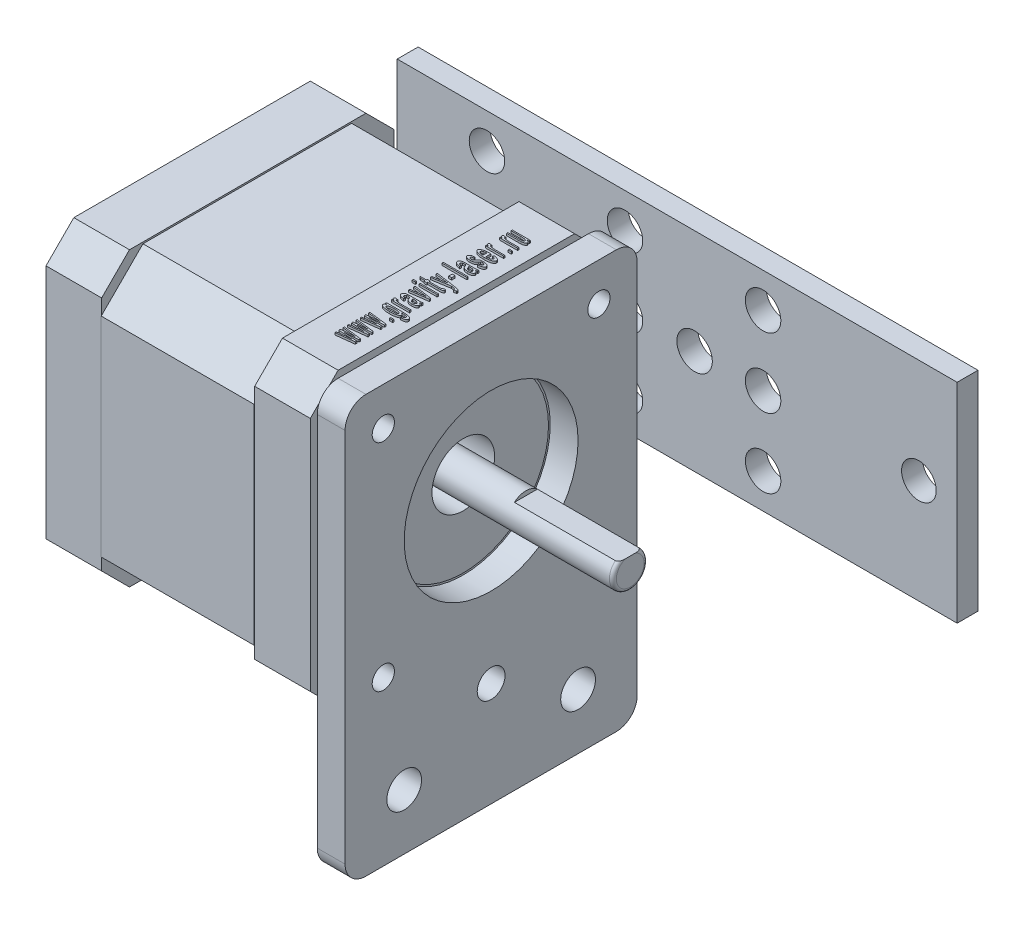
from build123d import *

# Parameters (mm, degrees)
SKETCH_1_R               = 12.5
SKETCH_1_R_2             = 1.6
SKETCH_1_R_3             = 2.5
EXTRUDE_1_DEPTH          = 4
SKETCH_2_W               = 65.5
SKETCH_2_H               = 30
SKETCH_2_R               = 2.55
EXTRUDE_2_DEPTH          = 3
SKETCH_3_W               = 15
SKETCH_3_H               = 30
EXTRUDE_3_DEPTH          = 3
SKETCH_4_R               = 2.492284787
CUT_EXTRUDE_1_DEPTH      = 10
CUT_EXTRUDE_2_DEPTH      = 10
CUT_EXTRUDE_2_DEPTH_BACK = 10
SKETCH_5_R               = 2
EXTRUDE_4_DEPTH          = 8
EXTRUDE_5_DEPTH          = 22
EXTRUDE_6_DEPTH          = 8
SKETCH_9_R               = 4.5
CUT_EXTRUDE_3_DEPTH      = 88
SKETCH_10_R              = 12.25
SKETCH_10_R_2            = 4.5
EXTRUDE_7_DEPTH          = 1
SKETCH_11_R              = 4
SKETCH_11_R_2            = 2.5
EXTRUDE_8_DEPTH          = 30
SKETCH_12_R              = 2.495
EXTRUDE_9_DEPTH          = 59
FILLET_1_R               = 0.5
CUT_EXTRUDE_4_DEPTH      = 55
CUT_EXTRUDE_4_DEPTH_BACK = 55
SKETCH_14_W              = 16.658255058
SKETCH_14_H              = 5.325088345
CUT_EXTRUDE_START        = -5
SKETCH_1_3_R             = 1.6
CUT_EXTRUDE_5_DEPTH      = 5
EXTRUDE_10_DEPTH         = 0.3
EXTRUDE_10_DEPTH_BACK    = 1
SKETCH_15_W              = 0.460980277
SKETCH_15_H              = 0.18439211
SKETCH_15_H_2            = 0.184392111
SKETCH_15_W_2            = 2.627587578
SKETCH_15_W_3            = 0.414882249
SKETCH_15_H_3            = 0.507078304
SKETCH_15_W_4            = 3.595646159


with BuildPart() as part:
    # Эскиз1 → Бобышка-Вытянуть1 (new body)
    with BuildSketch(Plane(origin=(0, 0, 0), x_dir=(0, 0, -1), z_dir=(1, 0, 0))):
        with BuildLine():
            Line((3, 0), (39, 0))
            ThreePointArc((39, 0), (41.121320344, 0.878679656), (42, 3))
            Line((42, 3), (42, 57))
            ThreePointArc((42, 57), (41.121320344, 59.121320344), (39, 60))
            Line((39, 60), (3, 60))
            ThreePointArc((3, 60), (0.878679656, 59.121320344), (0, 57))
            Line((0, 57), (0, 3))
            ThreePointArc((0, 3), (0.878679656, 0.878679656), (3, 0))
        make_face()
        with Locations((21, 39)):
            Circle(SKETCH_1_R, mode=Mode.SUBTRACT)
        with Locations((5.5, 54.5)):
            Circle(SKETCH_1_R_2, mode=Mode.SUBTRACT)
        with Locations((5.5, 23.5)):
            Circle(SKETCH_1_R_2, mode=Mode.SUBTRACT)
        with Locations(Location((36.5, 23.5, 0), (0, 0, 180))):
            Circle(SKETCH_1_R_2, mode=Mode.SUBTRACT)
        with Locations(Location((36.5, 54.5, 0), (0, 0, 180))):
            Circle(SKETCH_1_R_2, mode=Mode.SUBTRACT)
        with Locations((8.5, 8)):
            Circle(SKETCH_1_R_3, mode=Mode.SUBTRACT)
        with Locations(Location((33.5, 8, 0), (0, 0, 180))):
            Circle(SKETCH_1_R_3, mode=Mode.SUBTRACT)
    extrude(amount=EXTRUDE_1_DEPTH)

    # Эскиз5 → Вырез-Вытянуть2 (cut, two sides: drawn at the far end of the back side and taken through both)
    with BuildSketch(Plane(origin=(4, 0, 0), x_dir=(0, 0, -1), z_dir=(1, 0, 0)).offset(-CUT_EXTRUDE_2_DEPTH_BACK)):
        with Locations(Location((21, 15, 0), (0, 0, 180))):
            Circle(SKETCH_5_R)
    extrude(amount=CUT_EXTRUDE_2_DEPTH + CUT_EXTRUDE_2_DEPTH_BACK, mode=Mode.SUBTRACT)


with BuildPart() as body_2:
    # Эскиз2 → Бобышка-Вытянуть2 (new body)
    with BuildSketch(Plane.XY.offset(-80)):
        with Locations((-32.75, 15)):
            Rectangle(SKETCH_2_W, SKETCH_2_H)
        with Locations(Location((-22.75, 15, 0), (0, 0, 180))):
            Circle(SKETCH_2_R, mode=Mode.SUBTRACT)
        with Locations(Location((-12.9, 5, 0), (0, 0, 180))):
            Circle(SKETCH_2_R, mode=Mode.SUBTRACT)
        with Locations(Location((-12.9, 15, 0), (0, 0, 180))):
            Circle(SKETCH_2_R, mode=Mode.SUBTRACT)
        with Locations(Location((-12.9, 25, 0), (0, 0, 180))):
            Circle(SKETCH_2_R, mode=Mode.SUBTRACT)
        with Locations(Location((-42.75, 15, 0), (0, 0, 180))):
            Circle(SKETCH_2_R, mode=Mode.SUBTRACT)
        with Locations(Location((-52.6, 15, 0), (0, 0, 180))):
            Circle(SKETCH_2_R, mode=Mode.SUBTRACT)
        with Locations(Location((-52.6, 25, 0), (0, 0, 180))):
            Circle(SKETCH_2_R, mode=Mode.SUBTRACT)
        with Locations(Location((-52.6, 5, 0), (0, 0, 180))):
            Circle(SKETCH_2_R, mode=Mode.SUBTRACT)
        with Locations(Location((-32.75, 15, 0), (0, 0, 180))):
            Circle(SKETCH_2_R, mode=Mode.SUBTRACT)
        with Locations(Location((-32.75, 25, 0), (0, 0, 180))):
            Circle(SKETCH_2_R, mode=Mode.SUBTRACT)
        with Locations(Location((-32.75, 5, 0), (0, 0, 180))):
            Circle(SKETCH_2_R, mode=Mode.SUBTRACT)
    extrude(amount=EXTRUDE_2_DEPTH)

    # Эскиз3 → Бобышка-Вытянуть3 (add)
    with BuildSketch(Plane.XY.offset(-80)):
        with Locations((7.5, 15)):
            Rectangle(SKETCH_3_W, SKETCH_3_H)
    extrude(amount=EXTRUDE_3_DEPTH)

    # Эскиз4 → Вырез-Вытянуть1 (cut)
    with BuildSketch(Plane(origin=(0, 0, -80), x_dir=(-1, 0, 0), z_dir=(0, 0, -1))):
        with Locations((-9.5, 15)):
            Circle(SKETCH_4_R)
    extrude(amount=-CUT_EXTRUDE_1_DEPTH, mode=Mode.SUBTRACT)


with BuildPart() as body_3:
    # Эскиз6 → Бобышка-Вытянуть4 (new body)
    with BuildSketch(Plane.ZY.offset(1)):
        Polygon((-42, 56), (-38, 60), (-4, 60), (0, 56), (0, 22), (-4, 18), (-38, 18), (-42, 22), align=None)
    extrude(amount=EXTRUDE_4_DEPTH)

    # Эскиз7 → Бобышка-Вытянуть5 (add)
    with BuildSketch(Plane.ZY.offset(9)):
        Polygon((-41.940436671, 53.772364763), (-35.940436671, 59.772364763), (-5.940436671, 59.772364763), (0.059563329, 53.772364763), (0.059563329, 23.772364763), (-5.940436671, 17.772364763), (-35.940436671, 17.772364763), (-41.940436671, 23.772364763), align=None)
    extrude(amount=EXTRUDE_5_DEPTH)

    # Эскиз8 → Бобышка-Вытянуть6 (add)
    with BuildSketch(Plane.ZY.offset(31)):
        Polygon((-42, 56), (-38, 60), (-4, 60), (0, 56), (0, 22), (-4, 18), (-38, 18), (-42, 22), align=None)
    extrude(amount=EXTRUDE_6_DEPTH)

    # Эскиз9 → Вырез-Вытянуть3 (cut)
    with BuildSketch(Plane.ZY.offset(39)):
        with Locations((-21, 39)):
            Circle(SKETCH_9_R)
    extrude(amount=-CUT_EXTRUDE_3_DEPTH, mode=Mode.SUBTRACT)

    # Эскиз10 → Бобышка-Вытянуть7 (add)
    with BuildSketch(Plane(origin=(-1, 0, 0), x_dir=(0, 0, -1), z_dir=(1, 0, 0))):
        with Locations((21, 39)):
            Circle(SKETCH_10_R)
        with Locations(Location((21, 39, 0), (0, 0, 180))):
            Circle(SKETCH_10_R_2, mode=Mode.SUBTRACT)
    extrude(amount=EXTRUDE_7_DEPTH)

    # Эскиз1<3> → Вырез-Вытянуть5 (cut)
    with BuildSketch(Plane(origin=(0, 0, 0), x_dir=(0, 0, -1), z_dir=(1, 0, 0)).offset(CUT_EXTRUDE_START)):
        with Locations((5.5, 54.5)):
            Circle(SKETCH_1_3_R)
        with Locations((5.5, 23.5)):
            Circle(SKETCH_1_3_R)
        with Locations((36.5, 23.5)):
            Circle(SKETCH_1_3_R)
        with Locations((36.5, 54.5)):
            Circle(SKETCH_1_3_R)
    extrude(amount=CUT_EXTRUDE_5_DEPTH, mode=Mode.SUBTRACT)

    # Эскиз15 → Бобышка-Вытянуть10 (add, two sides: drawn at the far end of the back side and taken through both)
    # profile 1 of 21: a face of its own
    with BuildSketch(Plane(origin=(0, 60, 0), x_dir=(1, 0, 0), z_dir=(0, 1, 0)).offset(-EXTRUDE_10_DEPTH_BACK)):
        with BuildLine():
            Line((-3, 8.467386838), (-5.627587578, 8.154784588))
            Line((-5.627587578, 8.154784588), (-5.627587578, 8.347820079))
            Line((-5.627587578, 8.347820079), (-4.090506467, 8.519967401))
            Line((-4.090506467, 8.519967401), (-3.546693797, 8.56678571))
            add(Edge.make_bspline(
                [(-3.546693797, 8.56678571), (-3.552455013, 8.567279252), (-3.568527755, 8.568656145), (-3.599509703, 8.570706108), (-3.644429203, 8.573492821), (-3.70325396, 8.577825589), (-3.775934737, 8.584018128), (-3.862445283, 8.589196351), (-3.962787375, 8.596652947), (-4.034325271, 8.602069989), (-4.072499425, 8.604960639)],
                knots=[0, 0, 0, 0, 0.263229435, 0.734362201, 1.413431517, 2.312088188, 3.41947649, 4.733988812, 6.257186419, 8, 8, 8, 8], degree=3))
            Line((-4.072499425, 8.604960639), (-5.627587578, 8.738933032))
            Line((-5.627587578, 8.738933032), (-5.627587578, 8.9564581))
            Line((-5.627587578, 8.9564581), (-4.080422524, 9.08898993))
            Line((-4.080422524, 9.08898993), (-3.601435205, 9.122843169))
            Line((-3.601435205, 9.122843169), (-4.096268721, 9.172542605))
            Line((-4.096268721, 9.172542605), (-5.627587578, 9.345410209))
            Line((-5.627587578, 9.345410209), (-5.627587578, 9.537725418))
            Line((-5.627587578, 9.537725418), (-3, 9.220801478))
            Line((-3, 9.220801478), (-3, 9.01191979))
            Line((-3, 9.01191979), (-4.542843364, 8.87938796))
            Line((-4.542843364, 8.87938796), (-5.021110401, 8.846255003))
            Line((-5.021110401, 8.846255003), (-3, 8.679149652))
            Line((-3, 8.679149652), (-3, 8.467386838))
        make_face()
    # profile 2 of 21: a face of its own
    with BuildSketch(Plane(origin=(0, 60, 0), x_dir=(1, 0, 0), z_dir=(0, 1, 0)).offset(-EXTRUDE_10_DEPTH_BACK)):
        with BuildLine():
            Line((-3, 10.297478537), (-5.627587578, 9.984876286))
            Line((-5.627587578, 9.984876286), (-5.627587578, 10.177911777))
            Line((-5.627587578, 10.177911777), (-4.090506467, 10.350059099))
            Line((-4.090506467, 10.350059099), (-3.546693797, 10.396877409))
            add(Edge.make_bspline(
                [(-3.546693797, 10.396877409), (-3.552455013, 10.397370951), (-3.568527755, 10.398747844), (-3.599509703, 10.400797807), (-3.644429203, 10.40358452), (-3.70325396, 10.407917288), (-3.775934737, 10.414109827), (-3.862445283, 10.41928805), (-3.962787375, 10.426744646), (-4.034325271, 10.432161688), (-4.072499425, 10.435052338)],
                knots=[0, 0, 0, 0, 0.263229435, 0.734362201, 1.413431517, 2.312088188, 3.41947649, 4.733988812, 6.257186419, 8, 8, 8, 8], degree=3))
            Line((-4.072499425, 10.435052338), (-5.627587578, 10.569024731))
            Line((-5.627587578, 10.569024731), (-5.627587578, 10.786549799))
            Line((-5.627587578, 10.786549799), (-4.080422524, 10.919081629))
            Line((-4.080422524, 10.919081629), (-3.601435205, 10.952934868))
            Line((-3.601435205, 10.952934868), (-4.096268721, 11.002634304))
            Line((-4.096268721, 11.002634304), (-5.627587578, 11.175501908))
            Line((-5.627587578, 11.175501908), (-5.627587578, 11.367817117))
            Line((-5.627587578, 11.367817117), (-3, 11.050893176))
            Line((-3, 11.050893176), (-3, 10.842011489))
            Line((-3, 10.842011489), (-4.542843364, 10.709479659))
            Line((-4.542843364, 10.709479659), (-5.021110401, 10.676346702))
            Line((-5.021110401, 10.676346702), (-3, 10.509241351))
            Line((-3, 10.509241351), (-3, 10.297478537))
        make_face()
    # profile 3 of 21: a face of its own
    with BuildSketch(Plane(origin=(0, 60, 0), x_dir=(1, 0, 0), z_dir=(0, 1, 0)).offset(-EXTRUDE_10_DEPTH_BACK)):
        with BuildLine():
            Line((-3, 12.127570235), (-5.627587578, 11.814967985))
            Line((-5.627587578, 11.814967985), (-5.627587578, 12.008003476))
            Line((-5.627587578, 12.008003476), (-4.090506467, 12.180150798))
            Line((-4.090506467, 12.180150798), (-3.546693797, 12.226969108))
            add(Edge.make_bspline(
                [(-3.546693797, 12.226969108), (-3.552455013, 12.22746265), (-3.568527755, 12.228839543), (-3.599509703, 12.230889505), (-3.644429203, 12.233676219), (-3.70325396, 12.238008987), (-3.775934737, 12.244201526), (-3.862445283, 12.249379749), (-3.962787375, 12.256836345), (-4.034325271, 12.262253387), (-4.072499425, 12.265144037)],
                knots=[0, 0, 0, 0, 0.263229435, 0.734362201, 1.413431517, 2.312088188, 3.41947649, 4.733988812, 6.257186419, 8, 8, 8, 8], degree=3))
            Line((-4.072499425, 12.265144037), (-5.627587578, 12.39911643))
            Line((-5.627587578, 12.39911643), (-5.627587578, 12.616641498))
            Line((-5.627587578, 12.616641498), (-4.080422524, 12.749173327))
            Line((-4.080422524, 12.749173327), (-3.601435205, 12.783026566))
            Line((-3.601435205, 12.783026566), (-4.096268721, 12.832726003))
            Line((-4.096268721, 12.832726003), (-5.627587578, 13.005593606))
            Line((-5.627587578, 13.005593606), (-5.627587578, 13.197908816))
            Line((-5.627587578, 13.197908816), (-3, 12.880984875))
            Line((-3, 12.880984875), (-3, 12.672103187))
            Line((-3, 12.672103187), (-4.542843364, 12.539571358))
            Line((-4.542843364, 12.539571358), (-5.021110401, 12.5064384))
            Line((-5.021110401, 12.5064384), (-3, 12.33933305))
            Line((-3, 12.33933305), (-3, 12.127570235))
        make_face()
    # profile 4 of 21: a face of its own
    with BuildSketch(Plane(origin=(0, 60, 0), x_dir=(1, 0, 0), z_dir=(0, 1, 0)).offset(-EXTRUDE_10_DEPTH_BACK)):
        with Locations((-3.230490138, 13.944696864)):
            Rectangle(SKETCH_15_W, SKETCH_15_H)
    # profile 5 of 21: a face of its own
    with BuildSketch(Plane(origin=(0, 60, 0), x_dir=(1, 0, 0), z_dir=(0, 1, 0)).offset(-EXTRUDE_10_DEPTH_BACK)):
        with BuildLine():
            Line((-2.815607889, 14.760631954), (-2.769509862, 14.945024065))
            add(Edge.make_bspline(
                [(-2.769509862, 14.945024065), (-2.741829615, 14.946632284), (-2.690084669, 14.949638661), (-2.619328691, 14.961843459), (-2.559340672, 14.974533772), (-2.52563274, 14.989867736), (-2.510208456, 14.996884346)],
                knots=[0, 0, 0, 0, 1.248889373, 2.334650867, 3.237959222, 4, 4, 4, 4], degree=3))
            add(Edge.make_bspline(
                [(-2.510208456, 14.996884346), (-2.493448031, 15.006340979), (-2.462086645, 15.024035825), (-2.427382189, 15.062349713), (-2.403749007, 15.105143313), (-2.401742036, 15.136556516), (-2.40072564, 15.152465189)],
                knots=[0, 0, 0, 0, 1.14327361, 2.139244396, 3.057652518, 4, 4, 4, 4], degree=3))
            add(Edge.make_bspline(
                [(-2.40072564, 15.152465189), (-2.401726196, 15.169546158), (-2.403684299, 15.202973894), (-2.426815464, 15.248776213), (-2.461916078, 15.288512772), (-2.512089424, 15.319351673), (-2.57264372, 15.34550975), (-2.64452182, 15.366958599), (-2.726981514, 15.383873048), (-2.786011666, 15.391296844), (-2.817048453, 15.395200116)],
                knots=[0, 0, 0, 0, 0.772256192, 1.511318016, 2.286437148, 3.163518131, 4.167875067, 5.289326539, 6.574786063, 8, 8, 8, 8], degree=3))
            add(Edge.make_bspline(
                [(-2.817048453, 15.395200116), (-2.828326806, 15.396248969), (-2.853730321, 15.398611419), (-2.896279037, 15.400306672), (-2.947158581, 15.402730937), (-3.006236833, 15.404030275), (-3.073468483, 15.404570492), (-3.149098049, 15.405296698), (-3.233129294, 15.406209459), (-3.291953883, 15.40607473), (-3.322686194, 15.406004341)],
                knots=[0, 0, 0, 0, 0.537282225, 1.210181683, 2.019618873, 2.953906197, 4.01327095, 5.209313029, 6.54203387, 8, 8, 8, 8], degree=3))
            add(Edge.make_bspline(
                [(-3.322686194, 15.406004341), (-3.297335313, 15.396999531), (-3.249394565, 15.379970641), (-3.183636096, 15.350398623), (-3.127444702, 15.319801932), (-3.081642306, 15.28667223), (-3.045468042, 15.25203627), (-3.019260478, 15.215391395), (-3.002994368, 15.176313632), (-3.000988818, 15.14924477), (-3, 15.13589871)],
                knots=[0, 0, 0, 0, 1.44505194, 2.732720478, 3.87051748, 4.876895417, 5.761828904, 6.549226263, 7.284709022, 8, 8, 8, 8], degree=3))
            add(Edge.make_bspline(
                [(-3, 15.13589871), (-3.0009684, 15.119368784), (-3.002913838, 15.086161496), (-3.023564995, 15.039049107), (-3.054269123, 14.994816076), (-3.098788597, 14.955219323), (-3.153538101, 14.916821765), (-3.221378926, 14.88298708), (-3.300568145, 14.851062044), (-3.390968909, 14.823464595), (-3.489484232, 14.797721738), (-3.594045893, 14.775421567), (-3.703698338, 14.757062367), (-3.817939976, 14.740797024), (-3.937205077, 14.729786117), (-4.061123163, 14.721211145), (-4.189842045, 14.714941926), (-4.2772918, 14.71467137), (-4.321716887, 14.714533926)],
                knots=[0, 0, 0, 0, 0.535056287, 1.074884884, 1.647219554, 2.277541893, 3.001604, 3.81945128, 4.738021896, 5.778535566, 6.893038315, 8.051759058, 9.256827172, 10.511182975, 11.806636795, 13.154011892, 14.554218126, 16, 16, 16, 16], degree=3))
            add(Edge.make_bspline(
                [(-4.321716887, 14.714533926), (-4.382954608, 14.714995636), (-4.503104092, 14.715901519), (-4.679433263, 14.725695542), (-4.848640677, 14.740446735), (-5.008721119, 14.761741124), (-5.156551672, 14.788166301), (-5.288348274, 14.820978525), (-5.402304535, 14.859243467), (-5.485099529, 14.89665526), (-5.541232988, 14.929468261), (-5.576782216, 14.95439552), (-5.606154856, 14.981098605), (-5.630750367, 15.008071577), (-5.649713864, 15.036462594), (-5.66363302, 15.066003052), (-5.67183405, 15.09681127), (-5.673069518, 15.117605982), (-5.673685605, 15.127975612)],
                knots=[0, 0, 0, 0, 1.960309252, 3.846161164, 5.652040472, 7.396817701, 9.01451974, 10.457461939, 11.740907255, 12.858631906, 13.358257113, 13.821112033, 14.24561517, 14.626700231, 14.986985092, 15.334328333, 15.668051735, 16, 16, 16, 16], degree=3))
            add(Edge.make_bspline(
                [(-5.673685605, 15.127975612), (-5.672541694, 15.141836112), (-5.670205186, 15.170147009), (-5.651416157, 15.210840517), (-5.621354389, 15.248774395), (-5.580481191, 15.284990359), (-5.52720758, 15.317561431), (-5.46384303, 15.350076166), (-5.388520786, 15.380116108), (-5.333846404, 15.397043079), (-5.304901384, 15.406004341)],
                knots=[0, 0, 0, 0, 0.676302955, 1.381389014, 2.152233373, 3.034329793, 4.03823336, 5.199563299, 6.517428189, 8, 8, 8, 8], degree=3))
            Line((-5.304901384, 15.406004341), (-5.627587578, 15.406004341))
            Line((-5.627587578, 15.406004341), (-5.627587578, 15.590396452))
            Line((-5.627587578, 15.590396452), (-3.388231827, 15.590396452))
            add(Edge.make_bspline(
                [(-3.388231827, 15.590396452), (-3.339731914, 15.590270044), (-3.246328341, 15.590026602), (-3.111626054, 15.58785102), (-2.987719476, 15.584377383), (-2.874866208, 15.579311848), (-2.773214482, 15.573368334), (-2.682760663, 15.564221027), (-2.603157512, 15.55545476), (-2.51346797, 15.541347566), (-2.414678467, 15.519234771), (-2.307505968, 15.48686024), (-2.21354601, 15.446522889), (-2.133565762, 15.399538542), (-2.067821562, 15.346935022), (-2.0207789, 15.28637224), (-1.99117675, 15.219313583), (-1.987628189, 15.171960424), (-1.985843391, 15.148143499)],
                knots=[0, 0, 0, 0, 1.466719357, 2.824681989, 4.074084006, 5.215177491, 6.241047558, 7.152832486, 7.964300773, 8.662631576, 9.897518001, 11.022840065, 12.043945386, 12.981613822, 13.822029434, 14.572856839, 15.282198632, 16, 16, 16, 16], degree=3))
            add(Edge.make_bspline(
                [(-1.985843391, 15.148143499), (-1.986212522, 15.133655899), (-1.986935991, 15.105261257), (-1.99820183, 15.064230292), (-2.013352632, 15.024747053), (-2.037600285, 14.988627946), (-2.06636145, 14.953650775), (-2.102250423, 14.92094784), (-2.144954683, 14.891175468), (-2.193426057, 14.862827913), (-2.248568476, 14.837484641), (-2.310449827, 14.816361267), (-2.378772673, 14.798138647), (-2.453502268, 14.784348402), (-2.534671039, 14.772512254), (-2.622444624, 14.764936208), (-2.716881974, 14.76052594), (-2.781989584, 14.760595854), (-2.815607889, 14.760631954)],
                knots=[0, 0, 0, 0, 0.687635845, 1.347716178, 2.014498006, 2.693329913, 3.407824925, 4.16858901, 4.996754335, 5.883260036, 6.840067018, 7.881613529, 8.993890174, 10.204943585, 11.498690364, 12.899445736, 14.399029199, 16, 16, 16, 16], degree=3))
        make_face()
        with BuildLine():
            add(Edge.make_bspline(
                [(-4.353409281, 14.898926037), (-4.314033713, 14.899328928), (-4.237913801, 14.900107787), (-4.12789133, 14.902486186), (-4.026308923, 14.908412576), (-3.93309051, 14.916149168), (-3.848058117, 14.926257441), (-3.770971805, 14.937867493), (-3.702418679, 14.95346491), (-3.64151964, 14.969353106), (-3.588732766, 14.988726037), (-3.542509779, 15.00736677), (-3.503730034, 15.028573132), (-3.471863096, 15.050592193), (-3.446641319, 15.073970797), (-3.428020175, 15.098263837), (-3.417139923, 15.124738376), (-3.415632397, 15.142771558), (-3.414882249, 15.151744907)],
                knots=[0, 0, 0, 0, 1.842274345, 3.56144094, 5.147776956, 6.602033686, 7.936770111, 9.153727065, 10.246579223, 11.224842964, 12.095274606, 12.875512112, 13.554128895, 14.158706996, 14.683159799, 15.157194488, 15.580618227, 16, 16, 16, 16], degree=3))
            add(Edge.make_bspline(
                [(-3.414882249, 15.151744907), (-3.415632491, 15.160718164), (-3.417140207, 15.178751162), (-3.428018969, 15.205227153), (-3.446646681, 15.229513792), (-3.471593454, 15.252692337), (-3.503441329, 15.274574411), (-3.542387283, 15.294858438), (-3.58793507, 15.315269507), (-3.640773378, 15.333691961), (-3.700804713, 15.35107393), (-3.768604358, 15.366216364), (-3.844497429, 15.377780364), (-3.927983649, 15.38905984), (-4.01959612, 15.396409366), (-4.119003499, 15.402460058), (-4.226389776, 15.404819037), (-4.300588713, 15.405600009), (-4.339003648, 15.406004341)],
                knots=[0, 0, 0, 0, 0.425210039, 0.854518218, 1.3351407, 1.866881972, 2.46399905, 3.162058998, 3.947215136, 4.829743412, 5.813725128, 6.910647518, 8.122026991, 9.45410925, 10.905882552, 12.480154436, 14.177674165, 16, 16, 16, 16], degree=3))
            add(Edge.make_bspline(
                [(-4.339003648, 15.406004341), (-4.375981311, 15.405697178), (-4.447313461, 15.405104642), (-4.551063183, 15.401431521), (-4.64761897, 15.395805488), (-4.737513202, 15.388129351), (-4.819928413, 15.377417591), (-4.895574566, 15.364241599), (-4.964350692, 15.349871104), (-5.025729877, 15.331538978), (-5.079838083, 15.312262869), (-5.126919133, 15.291934588), (-5.167533003, 15.271770086), (-5.200285461, 15.249224762), (-5.226108733, 15.226221132), (-5.244929831, 15.20205429), (-5.256604174, 15.176249983), (-5.258081766, 15.158333615), (-5.258803356, 15.149584062)],
                knots=[0, 0, 0, 0, 1.764361063, 3.403559276, 4.95282211, 6.378935111, 7.707525984, 8.916655208, 10.04242927, 11.057426719, 11.970601119, 12.781385994, 13.503836198, 14.129837194, 14.673118611, 15.147399398, 15.583627986, 16, 16, 16, 16], degree=3))
            add(Edge.make_bspline(
                [(-5.258803356, 15.149584062), (-5.258116197, 15.140820804), (-5.256726446, 15.123097483), (-5.244707532, 15.097691646), (-5.226340244, 15.073944044), (-5.200936798, 15.051099092), (-5.168260933, 15.030108147), (-5.128863963, 15.008920202), (-5.082263077, 14.989182011), (-5.028594772, 14.970533751), (-4.968151034, 14.952973735), (-4.900304104, 14.939393562), (-4.825993777, 14.925860809), (-4.744653013, 14.9163414), (-4.656511461, 14.908405551), (-4.561641909, 14.902535516), (-4.459783038, 14.900098371), (-4.389663975, 14.899325596), (-4.353409281, 14.898926037)],
                knots=[0, 0, 0, 0, 0.423175551, 0.855854733, 1.337885288, 1.873595085, 2.503292768, 3.216950142, 4.040983278, 4.954207292, 5.971365108, 7.090316246, 8.307731766, 9.633462793, 11.059684886, 12.599395956, 14.241735538, 16, 16, 16, 16], degree=3))
        make_face(mode=Mode.SUBTRACT)
    # profile 6 of 21: a face of its own
    with BuildSketch(Plane(origin=(0, 60, 0), x_dir=(1, 0, 0), z_dir=(0, 1, 0)).offset(-EXTRUDE_10_DEPTH_BACK)):
        with BuildLine():
            Line((-3, 16.268037459), (-5.627587578, 16.268037459))
            Line((-5.627587578, 16.268037459), (-5.627587578, 16.406331542))
            Line((-5.627587578, 16.406331542), (-5.260964201, 16.406331542))
            add(Edge.make_bspline(
                [(-5.260964201, 16.406331542), (-5.299496475, 16.415999502), (-5.369780626, 16.433634182), (-5.46369398, 16.463238466), (-5.536894286, 16.490318229), (-5.590556377, 16.517307856), (-5.628672456, 16.544825997), (-5.653234469, 16.574208105), (-5.670802826, 16.604089616), (-5.672736382, 16.625560761), (-5.673685605, 16.636101399)],
                knots=[0, 0, 0, 0, 1.910431729, 3.484691049, 4.735072694, 5.659708583, 6.368816618, 6.975107921, 7.496858853, 8, 8, 8, 8], degree=3))
            add(Edge.make_bspline(
                [(-5.673685605, 16.636101399), (-5.671986153, 16.651732978), (-5.668414112, 16.684588637), (-5.642590619, 16.731784129), (-5.603265228, 16.77863875), (-5.569108497, 16.806208136), (-5.550517438, 16.821213791)],
                knots=[0, 0, 0, 0, 0.814693589, 1.712385845, 2.754881707, 4, 4, 4, 4], degree=3))
            Line((-5.550517438, 16.821213791), (-5.142117724, 16.762150693))
            add(Edge.make_bspline(
                [(-5.142117724, 16.762150693), (-5.159553245, 16.752356399), (-5.190704969, 16.734857115), (-5.227936387, 16.704216458), (-5.253755533, 16.673093334), (-5.257226274, 16.649639705), (-5.258803356, 16.638982525)],
                knots=[0, 0, 0, 0, 1.352648312, 2.416751838, 3.280582159, 4, 4, 4, 4], degree=3))
            add(Edge.make_bspline(
                [(-5.258803356, 16.638982525), (-5.257566511, 16.629847128), (-5.254961285, 16.610604803), (-5.235765999, 16.584554627), (-5.207819924, 16.55982007), (-5.168091724, 16.53829586), (-5.119287828, 16.518470248), (-5.061396344, 16.501346173), (-4.994880964, 16.487771942), (-4.947455622, 16.482082176), (-4.92243181, 16.479079992)],
                knots=[0, 0, 0, 0, 0.551688631, 1.162048167, 1.90516588, 2.812607804, 3.884347412, 5.101581694, 6.470660024, 8, 8, 8, 8], degree=3))
            add(Edge.make_bspline(
                [(-4.92243181, 16.479079992), (-4.881394668, 16.475018502), (-4.797491331, 16.466714498), (-4.668750837, 16.458230015), (-4.53424384, 16.453043943), (-4.442729149, 16.452637517), (-4.395905901, 16.45242957)],
                knots=[0, 0, 0, 0, 0.938135227, 1.918083781, 2.934793096, 4, 4, 4, 4], degree=3))
            Line((-4.395905901, 16.45242957), (-3, 16.45242957))
            Line((-3, 16.45242957), (-3, 16.268037459))
        make_face()
    # profile 7 of 21: a face of its own
    with BuildSketch(Plane(origin=(0, 60, 0), x_dir=(1, 0, 0), z_dir=(0, 1, 0)).offset(-EXTRUDE_10_DEPTH_BACK)):
        with BuildLine():
            add(Edge.make_bspline(
                [(-3.322686194, 17.959835075), (-3.29133679, 17.946724676), (-3.232649857, 17.922181656), (-3.152517263, 17.882897446), (-3.088702824, 17.840019387), (-3.038048605, 17.797192359), (-3.000318327, 17.752531044), (-2.973694512, 17.706228483), (-2.956676867, 17.658002734), (-2.954821508, 17.624795488), (-2.953901972, 17.608337614)],
                knots=[0, 0, 0, 0, 1.507922519, 2.822871786, 3.951541029, 4.910610408, 5.757644248, 6.530632161, 7.271765238, 8, 8, 8, 8], degree=3))
            add(Edge.make_bspline(
                [(-2.953901972, 17.608337614), (-2.954700266, 17.595085961), (-2.956273342, 17.568972917), (-2.965644167, 17.530682445), (-2.982612343, 17.495333887), (-3.005651233, 17.462014661), (-3.035041747, 17.431040721), (-3.072235795, 17.403857835), (-3.114564696, 17.377647051), (-3.181951516, 17.3468084), (-3.277359335, 17.314797193), (-3.404467556, 17.28791093), (-3.545785885, 17.271478023), (-3.644845034, 17.269431886), (-3.696512387, 17.268364659)],
                knots=[0, 0, 0, 0, 0.534682444, 1.053618465, 1.57767702, 2.106719939, 2.681939118, 3.289954347, 3.959104568, 4.686705671, 6.272652826, 8.006411766, 9.91702094, 12, 12, 12, 12], degree=3))
            add(Edge.make_bspline(
                [(-3.696512387, 17.268364659), (-3.727739362, 17.268729633), (-3.788582961, 17.269440759), (-3.877952984, 17.276448592), (-3.963146179, 17.285967245), (-4.043696904, 17.300387664), (-4.117910389, 17.318300594), (-4.185443244, 17.338210576), (-4.244990784, 17.360976878), (-4.297215374, 17.386327963), (-4.341933151, 17.414719361), (-4.381036344, 17.444246998), (-4.415031703, 17.475099949), (-4.433176061, 17.49834802), (-4.442003928, 17.509659023)],
                knots=[0, 0, 0, 0, 1.389708388, 2.707750614, 3.988300692, 5.204203801, 6.347336663, 7.385318213, 8.336000275, 9.181979917, 9.964777687, 10.689383759, 11.362339206, 12, 12, 12, 12], degree=3))
            add(Edge.make_bspline(
                [(-4.442003928, 17.509659023), (-4.447967338, 17.518909474), (-4.460744906, 17.538730058), (-4.476926275, 17.57330122), (-4.493704524, 17.613532755), (-4.503216321, 17.643066401), (-4.508269843, 17.658757331)],
                knots=[0, 0, 0, 0, 0.805930126, 1.726835266, 2.792290395, 4, 4, 4, 4], degree=3))
            add(Edge.make_bspline(
                [(-4.508269843, 17.658757331), (-4.518811071, 17.690639429), (-4.538739556, 17.750913423), (-4.574580967, 17.833345213), (-4.613372784, 17.902974703), (-4.64483391, 17.941241068), (-4.659528996, 17.959114793)],
                knots=[0, 0, 0, 0, 1.189020977, 2.247877315, 3.181606128, 4, 4, 4, 4], degree=3))
            add(Edge.make_bspline(
                [(-4.659528996, 17.959114793), (-4.672255304, 17.959000252), (-4.695309522, 17.958792756), (-4.726030068, 17.960019606), (-4.749084304, 17.959810556), (-4.761809076, 17.959828117), (-4.766850967, 17.959835075)],
                knots=[0, 0, 0, 0, 1.422707779, 2.577292221, 3.436285597, 4, 4, 4, 4], degree=3))
            add(Edge.make_bspline(
                [(-4.766850967, 17.959835075), (-4.80553331, 17.959340981), (-4.876748614, 17.958431341), (-4.974394862, 17.950652959), (-5.054442101, 17.938987217), (-5.099775641, 17.922969304), (-5.119788991, 17.915897892)],
                knots=[0, 0, 0, 0, 1.297849472, 2.389378144, 3.288960443, 4, 4, 4, 4], degree=3))
            add(Edge.make_bspline(
                [(-5.119788991, 17.915897892), (-5.140603216, 17.905874998), (-5.179561925, 17.887114799), (-5.225217644, 17.845248913), (-5.25432379, 17.794613921), (-5.257292396, 17.757565489), (-5.258803356, 17.738708598)],
                knots=[0, 0, 0, 0, 1.152590404, 2.157343529, 3.062125739, 4, 4, 4, 4], degree=3))
            add(Edge.make_bspline(
                [(-5.258803356, 17.738708598), (-5.257803705, 17.721498795), (-5.255873886, 17.688275386), (-5.23795402, 17.642260524), (-5.208309991, 17.603516206), (-5.165546975, 17.572446095), (-5.108279699, 17.548428108), (-5.03564271, 17.528148343), (-4.945684036, 17.51134005), (-4.879751551, 17.503250821), (-4.843921107, 17.498854798)],
                knots=[0, 0, 0, 0, 0.776462873, 1.498956392, 2.196669391, 2.957382431, 3.862181403, 4.993689049, 6.366246057, 8, 8, 8, 8], degree=3))
            Line((-4.843921107, 17.498854798), (-4.890019135, 17.314462687))
            add(Edge.make_bspline(
                [(-4.890019135, 17.314462687), (-4.933035055, 17.318419273), (-5.01493796, 17.325952667), (-5.130842628, 17.342317796), (-5.233764916, 17.362438906), (-5.32463818, 17.385576336), (-5.404026189, 17.414534525), (-5.473794542, 17.448385795), (-5.533723733, 17.48861524), (-5.584195004, 17.534302122), (-5.624579363, 17.584856688), (-5.65289829, 17.640254812), (-5.670425928, 17.699484647), (-5.672585757, 17.740268839), (-5.673685605, 17.76103733)],
                knots=[0, 0, 0, 0, 1.568613024, 2.986660754, 4.248631518, 5.375876238, 6.388245767, 7.312401625, 8.185413601, 9.000089996, 9.776297159, 10.521115194, 11.246909057, 12, 12, 12, 12], degree=3))
            add(Edge.make_bspline(
                [(-5.673685605, 17.76103733), (-5.672724032, 17.781291659), (-5.67086595, 17.820429791), (-5.656380143, 17.876206728), (-5.631346331, 17.925857597), (-5.596066807, 17.96838668), (-5.553573361, 18.004688005), (-5.507114499, 18.037769024), (-5.454138205, 18.063250828), (-5.396645524, 18.085320867), (-5.332282477, 18.102215624), (-5.261072103, 18.116430789), (-5.181976441, 18.128052147), (-5.126543247, 18.132992075), (-5.097460259, 18.135583805)],
                knots=[0, 0, 0, 0, 0.954834083, 1.845058528, 2.696153148, 3.557737005, 4.432622258, 5.328164097, 6.240035035, 7.197285065, 8.230540111, 9.374648699, 10.622611235, 12, 12, 12, 12], degree=3))
            add(Edge.make_bspline(
                [(-5.097460259, 18.135583805), (-5.075135688, 18.136870832), (-5.023551642, 18.139844688), (-4.935655848, 18.142546111), (-4.826637533, 18.143680073), (-4.746923372, 18.144034154), (-4.703466179, 18.144227185)],
                knots=[0, 0, 0, 0, 0.680786621, 1.573052813, 2.676918775, 4, 4, 4, 4], degree=3))
            Line((-4.703466179, 18.144227185), (-4.140926185, 18.144227185))
            add(Edge.make_bspline(
                [(-4.140926185, 18.144227185), (-4.093867616, 18.144157164), (-4.004071508, 18.14402355), (-3.875621997, 18.144926561), (-3.759657854, 18.145701569), (-3.656170101, 18.146083307), (-3.565181636, 18.147844341), (-3.486655593, 18.148905452), (-3.420636221, 18.151234654), (-3.318724704, 18.155189668), (-3.179476103, 18.164832071), (-3.058983193, 18.181947123), (-3, 18.190325213)],
                knots=[0, 0, 0, 0, 1.235093393, 2.356777543, 3.371338114, 4.278775548, 5.072864175, 5.759842952, 6.33988881, 6.806582623, 8.436771468, 10, 10, 10, 10], degree=3))
            Line((-3, 18.190325213), (-3, 18.005933102))
            add(Edge.make_bspline(
                [(-3, 18.005933102), (-3.023942523, 18.000083985), (-3.073432622, 17.987993639), (-3.151515024, 17.975742589), (-3.235074821, 17.965232589), (-3.292884382, 17.961671089), (-3.322686194, 17.959835075)],
                knots=[0, 0, 0, 0, 0.905519738, 1.871743526, 2.902847589, 4, 4, 4, 4], degree=3))
        make_face()
        with BuildLine():
            add(Edge.make_bspline(
                [(-4.244646747, 17.959835075), (-4.230745577, 17.943117817), (-4.201394883, 17.907821284), (-4.164301479, 17.844489416), (-4.129803139, 17.770458303), (-4.111119412, 17.716103946), (-4.101310692, 17.687568599)],
                knots=[0, 0, 0, 0, 0.840882937, 1.775425805, 2.8321268, 4, 4, 4, 4], degree=3))
            add(Edge.make_bspline(
                [(-4.101310692, 17.687568599), (-4.095848599, 17.67160366), (-4.085584486, 17.641603083), (-4.066706911, 17.601243407), (-4.047741797, 17.567773381), (-4.026771952, 17.541096073), (-4.002443253, 17.519717137), (-3.973208733, 17.502989244), (-3.939737297, 17.48765092), (-3.887742159, 17.470323295), (-3.814670338, 17.455756801), (-3.753973789, 17.453782434), (-3.722442528, 17.45275677)],
                knots=[0, 0, 0, 0, 1.035083953, 1.945082058, 2.73123162, 3.391855107, 4.018560245, 4.706093149, 5.451390205, 6.276371761, 8.065611698, 10, 10, 10, 10], degree=3))
            add(Edge.make_bspline(
                [(-3.722442528, 17.45275677), (-3.698139374, 17.453086794), (-3.651461384, 17.453720657), (-3.585054184, 17.464686408), (-3.524348785, 17.478807395), (-3.471310192, 17.501296684), (-3.426011293, 17.528140466), (-3.392322354, 17.563112595), (-3.372485427, 17.605320376), (-3.370030346, 17.635510592), (-3.368784221, 17.650834233)],
                knots=[0, 0, 0, 0, 1.297980553, 2.492973756, 3.592380701, 4.622644034, 5.563214531, 6.389954162, 7.182789382, 8, 8, 8, 8], degree=3))
            add(Edge.make_bspline(
                [(-3.368784221, 17.650834233), (-3.369956164, 17.666678208), (-3.372350537, 17.699048723), (-3.395271918, 17.744636927), (-3.430604684, 17.786678132), (-3.478526973, 17.824503358), (-3.535364692, 17.859345647), (-3.600113208, 17.88829854), (-3.670426214, 17.914276273), (-3.72036721, 17.926261817), (-3.746211823, 17.932464371)],
                knots=[0, 0, 0, 0, 0.751286764, 1.534939262, 2.380773948, 3.357101758, 4.431177073, 5.553065261, 6.733704065, 8, 8, 8, 8], degree=3))
            add(Edge.make_bspline(
                [(-3.746211823, 17.932464371), (-3.769218772, 17.936596174), (-3.819793873, 17.945678924), (-3.903798143, 17.953678537), (-4.002329491, 17.958607878), (-4.07297186, 17.958938394), (-4.110674354, 17.959114793)],
                knots=[0, 0, 0, 0, 0.766129154, 1.68414589, 2.76400694, 4, 4, 4, 4], degree=3))
            Line((-4.110674354, 17.959114793), (-4.244646747, 17.959835075))
        make_face(mode=Mode.SUBTRACT)
    # profile 8 of 21: a face of its own
    with BuildSketch(Plane(origin=(0, 60, 0), x_dir=(1, 0, 0), z_dir=(0, 1, 0)).offset(-EXTRUDE_10_DEPTH_BACK)):
        with BuildLine():
            Line((-3, 19.113582274), (-5.627587578, 18.729672137))
            Line((-5.627587578, 18.729672137), (-5.627587578, 18.927029318))
            Line((-5.627587578, 18.927029318), (-4.053772101, 19.145994949))
            add(Edge.make_bspline(
                [(-4.053772101, 19.145994949), (-3.967139609, 19.158082966), (-3.79092897, 19.182670014), (-3.614204448, 19.203242986), (-3.524365065, 19.213701427)],
                knots=[0, 0, 0, 0, 0.983283328, 2, 2, 2, 2], degree=3))
            add(Edge.make_bspline(
                [(-3.524365065, 19.213701427), (-3.560876425, 19.217887534), (-3.637331588, 19.226653285), (-3.756987467, 19.243212116), (-3.887273179, 19.259842141), (-3.977443274, 19.273091218), (-4.024240552, 19.279967342)],
                knots=[0, 0, 0, 0, 0.874518279, 1.831250253, 2.874442957, 4, 4, 4, 4], degree=3))
            Line((-4.024240552, 19.279967342), (-5.627587578, 19.500373537))
            Line((-5.627587578, 19.500373537), (-5.627587578, 19.697730718))
            Line((-5.627587578, 19.697730718), (-3, 19.313820581))
            Line((-3, 19.313820581), (-3, 19.113582274))
        make_face()
    # profile 9 of 21: a face of its own
    with BuildSketch(Plane(origin=(0, 60, 0), x_dir=(1, 0, 0), z_dir=(0, 1, 0)).offset(-EXTRUDE_10_DEPTH_BACK)):
        with Locations((-6.365156021, 20.329273697)):
            Rectangle(SKETCH_15_W, SKETCH_15_H_2)
    # profile 10 of 21: a face of its own
    with BuildSketch(Plane(origin=(0, 60, 0), x_dir=(1, 0, 0), z_dir=(0, 1, 0)).offset(-EXTRUDE_10_DEPTH_BACK)):
        with Locations((-4.313793789, 20.329273697)):
            Rectangle(SKETCH_15_W_2, SKETCH_15_H_2)
    # profile 11 of 21: a face of its own
    with BuildSketch(Plane(origin=(0, 60, 0), x_dir=(1, 0, 0), z_dir=(0, 1, 0)).offset(-EXTRUDE_10_DEPTH_BACK)):
        with BuildLine():
            Line((-3.380308728, 21.421796953), (-2.993517465, 21.467894981))
            add(Edge.make_bspline(
                [(-2.993517465, 21.467894981), (-2.987472119, 21.456252195), (-2.975993154, 21.434144751), (-2.963891562, 21.400464919), (-2.954977624, 21.368959094), (-2.954248593, 21.348141908), (-2.953901972, 21.338244278)],
                knots=[0, 0, 0, 0, 1.148269733, 2.180346592, 3.13483717, 4, 4, 4, 4], degree=3))
            add(Edge.make_bspline(
                [(-2.953901972, 21.338244278), (-2.954518241, 21.323447828), (-2.955713479, 21.294750438), (-2.97123143, 21.254841555), (-2.994794272, 21.219458424), (-3.028912056, 21.191062271), (-3.069792013, 21.167666013), (-3.116414149, 21.147345884), (-3.168821358, 21.131039923), (-3.217497827, 21.120892141), (-3.262792442, 21.114286611), (-3.305827704, 21.110226695), (-3.357223043, 21.106652983), (-3.417023491, 21.103884919), (-3.485457692, 21.10171303), (-3.562300571, 21.10061884), (-3.647525294, 21.098671893), (-3.707075188, 21.098959833), (-3.738288725, 21.09911076)],
                knots=[0, 0, 0, 0, 0.788960515, 1.530171644, 2.262047673, 3.04669143, 3.883349545, 4.782525287, 5.767691149, 6.820416955, 7.44479214, 8.220943831, 9.137095261, 10.206683237, 11.430100809, 12.807609353, 14.326683771, 16, 16, 16, 16], degree=3))
            Line((-3.738288725, 21.09911076), (-5.212705329, 21.09911076))
            Line((-5.212705329, 21.09911076), (-5.212705329, 20.960816676))
            Line((-5.212705329, 20.960816676), (-5.627587578, 20.960816676))
            Line((-5.627587578, 20.960816676), (-5.627587578, 21.09911076))
            Line((-5.627587578, 21.09911076), (-6.267197712, 21.09911076))
            Line((-6.267197712, 21.09911076), (-6.529380244, 21.28350287))
            Line((-6.529380244, 21.28350287), (-5.627587578, 21.28350287))
            Line((-5.627587578, 21.28350287), (-5.627587578, 21.421796953))
            Line((-5.627587578, 21.421796953), (-5.212705329, 21.421796953))
            Line((-5.212705329, 21.421796953), (-5.212705329, 21.28350287))
            Line((-5.212705329, 21.28350287), (-3.721722246, 21.28350287))
            add(Edge.make_bspline(
                [(-3.721722246, 21.28350287), (-3.693629916, 21.283671026), (-3.642963398, 21.283974306), (-3.575252338, 21.285318143), (-3.524069386, 21.287274703), (-3.479435179, 21.290481916), (-3.439109947, 21.298044885), (-3.40248665, 21.311660375), (-3.373820091, 21.331715925), (-3.370397671, 21.351816954), (-3.368784221, 21.361293292)],
                knots=[0, 0, 0, 0, 1.75532608, 3.165855712, 4.231965107, 4.954568629, 5.963741049, 6.771636347, 7.420905799, 8, 8, 8, 8], degree=3))
            add(Edge.make_bspline(
                [(-3.368784221, 21.361293292), (-3.369473251, 21.370225816), (-3.371060378, 21.390801216), (-3.376966607, 21.410595872), (-3.380308728, 21.421796953)],
                knots=[0, 0, 0, 0, 0.868272213, 2, 2, 2, 2], degree=3))
        make_face()
    # profile 12 of 21: a face of its own
    with BuildSketch(Plane(origin=(0, 60, 0), x_dir=(1, 0, 0), z_dir=(0, 1, 0)).offset(-EXTRUDE_10_DEPTH_BACK)):
        with BuildLine():
            Line((-2.037703672, 22.053339932), (-2.439620851, 22.007241905))
            add(Edge.make_bspline(
                [(-2.439620851, 22.007241905), (-2.428138282, 22.024652924), (-2.407750808, 22.055566451), (-2.402861296, 22.092116775), (-2.40072564, 22.10808134)],
                knots=[0, 0, 0, 0, 1.12643375, 2, 2, 2, 2], degree=3))
            add(Edge.make_bspline(
                [(-2.40072564, 22.10808134), (-2.401181207, 22.117532816), (-2.402070632, 22.135985361), (-2.411919783, 22.16178164), (-2.427863299, 22.18442807), (-2.458873476, 22.211253663), (-2.512032181, 22.239373075), (-2.560030844, 22.252697018), (-2.586558314, 22.260060775)],
                knots=[0, 0, 0, 0, 0.652207712, 1.273334677, 1.882539573, 2.553983173, 4.095486401, 6, 6, 6, 6], degree=3))
            add(Edge.make_bspline(
                [(-2.586558314, 22.260060775), (-2.593033199, 22.261537774), (-2.608093523, 22.264973214), (-2.633833592, 22.269794381), (-2.665749029, 22.275653344), (-2.70370771, 22.282011091), (-2.747880328, 22.289238831), (-2.798003555, 22.29731785), (-2.854555937, 22.304835718), (-2.894129119, 22.310888587), (-2.915006761, 22.314081901)],
                knots=[0, 0, 0, 0, 0.478705345, 1.113449486, 1.887470153, 2.817906099, 3.887763949, 5.11416544, 6.477518859, 8, 8, 8, 8], degree=3))
            add(Edge.make_bspline(
                [(-2.915006761, 22.314081901), (-2.930136494, 22.316216782), (-2.96594421, 22.32126943), (-3.001687787, 22.326758379), (-3.022328732, 22.329928098)],
                knots=[0, 0, 0, 0, 0.845054295, 2, 2, 2, 2], degree=3))
            Line((-3.022328732, 22.329928098), (-5.627587578, 21.915045849))
            Line((-5.627587578, 21.915045849), (-5.627587578, 22.113123312))
            Line((-5.627587578, 22.113123312), (-4.222318015, 22.342893169))
            add(Edge.make_bspline(
                [(-4.222318015, 22.342893169), (-4.130786513, 22.358674797), (-3.942918025, 22.391066603), (-3.755753845, 22.427308821), (-3.659778021, 22.445893449)],
                knots=[0, 0, 0, 0, 0.97442102, 2, 2, 2, 2], degree=3))
            add(Edge.make_bspline(
                [(-3.659778021, 22.445893449), (-3.684968504, 22.449191445), (-3.741716661, 22.456621044), (-3.836921381, 22.464529129), (-3.951438154, 22.473294038), (-4.034315808, 22.478423029), (-4.07898196, 22.481187252)],
                knots=[0, 0, 0, 0, 0.724439803, 1.631990332, 2.723782899, 4, 4, 4, 4], degree=3))
            Line((-4.07898196, 22.481187252), (-5.627587578, 22.69871232))
            Line((-5.627587578, 22.69871232), (-5.627587578, 22.893908656))
            Line((-5.627587578, 22.893908656), (-2.948860001, 22.517921618))
            add(Edge.make_bspline(
                [(-2.948860001, 22.517921618), (-2.916188468, 22.512996402), (-2.853423775, 22.503534658), (-2.76351863, 22.488078694), (-2.68120495, 22.474174483), (-2.606786579, 22.462765149), (-2.540737641, 22.449767967), (-2.482518705, 22.439350952), (-2.432072397, 22.429344892), (-2.401194234, 22.422418123), (-2.387040288, 22.419243027)],
                knots=[0, 0, 0, 0, 1.389896415, 2.670104974, 3.837401809, 4.901755882, 5.836768036, 6.668788049, 7.389798491, 8, 8, 8, 8], degree=3))
            add(Edge.make_bspline(
                [(-2.387040288, 22.419243027), (-2.354793324, 22.411379191), (-2.294215405, 22.396606489), (-2.210782272, 22.371569772), (-2.141494631, 22.343196081), (-2.085172818, 22.314175243), (-2.041073036, 22.282447335), (-2.009824657, 22.24713421), (-1.988841954, 22.208584339), (-1.986833754, 22.180831181), (-1.985843391, 22.167144438)],
                knots=[0, 0, 0, 0, 1.576082391, 2.960768387, 4.131533391, 5.126064051, 5.965147716, 6.692284844, 7.355087436, 8, 8, 8, 8], degree=3))
            add(Edge.make_bspline(
                [(-1.985843391, 22.167144438), (-1.986373837, 22.158412868), (-1.987511102, 22.139692561), (-1.998730754, 22.111898682), (-2.014822306, 22.082148247), (-2.029679878, 22.063442126), (-2.037703672, 22.053339932)],
                knots=[0, 0, 0, 0, 0.818984814, 1.755886626, 2.788072209, 4, 4, 4, 4], degree=3))
        make_face()
    # profile 13 of 21: a face of its own
    with BuildSketch(Plane(origin=(0, 60, 0), x_dir=(1, 0, 0), z_dir=(0, 1, 0)).offset(-EXTRUDE_10_DEPTH_BACK)):
        with Locations((-4.267695762, 23.629892479)):
            Rectangle(SKETCH_15_W_3, SKETCH_15_H_3)
    # profile 14 of 21: a face of its own
    with BuildSketch(Plane(origin=(0, 60, 0), x_dir=(1, 0, 0), z_dir=(0, 1, 0)).offset(-EXTRUDE_10_DEPTH_BACK)):
        with Locations((-4.79782308, 24.607170665)):
            Rectangle(SKETCH_15_W_4, SKETCH_15_H_2)
    # profile 15 of 21: a face of its own
    with BuildSketch(Plane(origin=(0, 60, 0), x_dir=(1, 0, 0), z_dir=(0, 1, 0)).offset(-EXTRUDE_10_DEPTH_BACK)):
        with BuildLine():
            add(Edge.make_bspline(
                [(-3.322686194, 26.022380115), (-3.29133679, 26.009269717), (-3.232649857, 25.984726697), (-3.152517263, 25.945442487), (-3.088702824, 25.902564428), (-3.038048605, 25.8597374), (-3.000318327, 25.815076085), (-2.973694512, 25.768773524), (-2.956676867, 25.720547775), (-2.954821508, 25.687340529), (-2.953901972, 25.670882654)],
                knots=[0, 0, 0, 0, 1.507922519, 2.822871786, 3.951541029, 4.910610408, 5.757644248, 6.530632161, 7.271765238, 8, 8, 8, 8], degree=3))
            add(Edge.make_bspline(
                [(-2.953901972, 25.670882654), (-2.954700266, 25.657631002), (-2.956273342, 25.631517958), (-2.965644167, 25.593227486), (-2.982612343, 25.557878928), (-3.005651233, 25.524559702), (-3.035041747, 25.493585762), (-3.072235795, 25.466402875), (-3.114564696, 25.440192092), (-3.181951516, 25.409353441), (-3.277359335, 25.377342234), (-3.404467556, 25.350455971), (-3.545785885, 25.334023064), (-3.644845034, 25.331976927), (-3.696512387, 25.3309097)],
                knots=[0, 0, 0, 0, 0.534682444, 1.053618465, 1.57767702, 2.106719939, 2.681939118, 3.289954347, 3.959104568, 4.686705671, 6.272652826, 8.006411766, 9.91702094, 12, 12, 12, 12], degree=3))
            add(Edge.make_bspline(
                [(-3.696512387, 25.3309097), (-3.727739362, 25.331274674), (-3.788582961, 25.3319858), (-3.877952984, 25.338993633), (-3.963146179, 25.348512285), (-4.043696904, 25.362932705), (-4.117910389, 25.380845635), (-4.185443244, 25.400755617), (-4.244990784, 25.423521918), (-4.297215374, 25.448873004), (-4.341933151, 25.477264402), (-4.381036344, 25.506792038), (-4.415031703, 25.53764499), (-4.433176061, 25.560893061), (-4.442003928, 25.572204064)],
                knots=[0, 0, 0, 0, 1.389708388, 2.707750614, 3.988300692, 5.204203801, 6.347336663, 7.385318213, 8.336000275, 9.181979917, 9.964777687, 10.689383759, 11.362339206, 12, 12, 12, 12], degree=3))
            add(Edge.make_bspline(
                [(-4.442003928, 25.572204064), (-4.447967338, 25.581454515), (-4.460744906, 25.601275099), (-4.476926275, 25.63584626), (-4.493704524, 25.676077796), (-4.503216321, 25.705611442), (-4.508269843, 25.721302372)],
                knots=[0, 0, 0, 0, 0.805930126, 1.726835266, 2.792290395, 4, 4, 4, 4], degree=3))
            add(Edge.make_bspline(
                [(-4.508269843, 25.721302372), (-4.518811071, 25.75318447), (-4.538739556, 25.813458464), (-4.574580967, 25.895890254), (-4.613372784, 25.965519744), (-4.64483391, 26.003786109), (-4.659528996, 26.021659834)],
                knots=[0, 0, 0, 0, 1.189020977, 2.247877315, 3.181606128, 4, 4, 4, 4], degree=3))
            add(Edge.make_bspline(
                [(-4.659528996, 26.021659834), (-4.672255304, 26.021545293), (-4.695309522, 26.021337797), (-4.726030068, 26.022564647), (-4.749084304, 26.022355597), (-4.761809076, 26.022373157), (-4.766850967, 26.022380115)],
                knots=[0, 0, 0, 0, 1.422707779, 2.577292221, 3.436285597, 4, 4, 4, 4], degree=3))
            add(Edge.make_bspline(
                [(-4.766850967, 26.022380115), (-4.80553331, 26.021886022), (-4.876748614, 26.020976382), (-4.974394862, 26.013198), (-5.054442101, 26.001532258), (-5.099775641, 25.985514344), (-5.119788991, 25.978442933)],
                knots=[0, 0, 0, 0, 1.297849472, 2.389378144, 3.288960443, 4, 4, 4, 4], degree=3))
            add(Edge.make_bspline(
                [(-5.119788991, 25.978442933), (-5.140603216, 25.968420039), (-5.179561925, 25.94965984), (-5.225217644, 25.907793954), (-5.25432379, 25.857158962), (-5.257292396, 25.82011053), (-5.258803356, 25.801253639)],
                knots=[0, 0, 0, 0, 1.152590404, 2.157343529, 3.062125739, 4, 4, 4, 4], degree=3))
            add(Edge.make_bspline(
                [(-5.258803356, 25.801253639), (-5.257803705, 25.784043836), (-5.255873886, 25.750820427), (-5.23795402, 25.704805565), (-5.208309991, 25.666061246), (-5.165546975, 25.634991136), (-5.108279699, 25.610973149), (-5.03564271, 25.590693383), (-4.945684036, 25.573885091), (-4.879751551, 25.565795861), (-4.843921107, 25.561399839)],
                knots=[0, 0, 0, 0, 0.776462873, 1.498956392, 2.196669391, 2.957382431, 3.862181403, 4.993689049, 6.366246057, 8, 8, 8, 8], degree=3))
            Line((-4.843921107, 25.561399839), (-4.890019135, 25.377007728))
            add(Edge.make_bspline(
                [(-4.890019135, 25.377007728), (-4.933035055, 25.380964314), (-5.01493796, 25.388497708), (-5.130842628, 25.404862837), (-5.233764916, 25.424983947), (-5.32463818, 25.448121377), (-5.404026189, 25.477079565), (-5.473794542, 25.510930836), (-5.533723733, 25.55116028), (-5.584195004, 25.596847162), (-5.624579363, 25.647401728), (-5.65289829, 25.702799852), (-5.670425928, 25.762029688), (-5.672585757, 25.80281388), (-5.673685605, 25.823582371)],
                knots=[0, 0, 0, 0, 1.568613024, 2.986660754, 4.248631518, 5.375876238, 6.388245767, 7.312401625, 8.185413601, 9.000089996, 9.776297159, 10.521115194, 11.246909057, 12, 12, 12, 12], degree=3))
            add(Edge.make_bspline(
                [(-5.673685605, 25.823582371), (-5.672724032, 25.8438367), (-5.67086595, 25.882974832), (-5.656380143, 25.938751769), (-5.631346331, 25.988402638), (-5.596066807, 26.030931721), (-5.553573361, 26.067233046), (-5.507114499, 26.100314065), (-5.454138205, 26.125795869), (-5.396645524, 26.147865908), (-5.332282477, 26.164760664), (-5.261072103, 26.17897583), (-5.181976441, 26.190597188), (-5.126543247, 26.195537116), (-5.097460259, 26.198128846)],
                knots=[0, 0, 0, 0, 0.954834083, 1.845058528, 2.696153148, 3.557737005, 4.432622258, 5.328164097, 6.240035035, 7.197285065, 8.230540111, 9.374648699, 10.622611235, 12, 12, 12, 12], degree=3))
            add(Edge.make_bspline(
                [(-5.097460259, 26.198128846), (-5.075135688, 26.199415873), (-5.023551642, 26.202389728), (-4.935655848, 26.205091151), (-4.826637533, 26.206225113), (-4.746923372, 26.206579194), (-4.703466179, 26.206772226)],
                knots=[0, 0, 0, 0, 0.680786621, 1.573052813, 2.676918775, 4, 4, 4, 4], degree=3))
            Line((-4.703466179, 26.206772226), (-4.140926185, 26.206772226))
            add(Edge.make_bspline(
                [(-4.140926185, 26.206772226), (-4.093867616, 26.206702205), (-4.004071508, 26.206568591), (-3.875621997, 26.207471601), (-3.759657854, 26.20824661), (-3.656170101, 26.208628348), (-3.565181636, 26.210389382), (-3.486655593, 26.211450492), (-3.420636221, 26.213779695), (-3.318724704, 26.217734709), (-3.179476103, 26.227377112), (-3.058983193, 26.244492164), (-3, 26.252870254)],
                knots=[0, 0, 0, 0, 1.235093393, 2.356777543, 3.371338114, 4.278775548, 5.072864175, 5.759842952, 6.33988881, 6.806582623, 8.436771468, 10, 10, 10, 10], degree=3))
            Line((-3, 26.252870254), (-3, 26.068478143))
            add(Edge.make_bspline(
                [(-3, 26.068478143), (-3.023942523, 26.062629026), (-3.073432622, 26.050538679), (-3.151515024, 26.03828763), (-3.235074821, 26.02777763), (-3.292884382, 26.02421613), (-3.322686194, 26.022380115)],
                knots=[0, 0, 0, 0, 0.905519738, 1.871743526, 2.902847589, 4, 4, 4, 4], degree=3))
        make_face()
        with BuildLine():
            add(Edge.make_bspline(
                [(-4.244646747, 26.022380115), (-4.230745577, 26.005662857), (-4.201394883, 25.970366325), (-4.164301479, 25.907034457), (-4.129803139, 25.833003344), (-4.111119412, 25.778648987), (-4.101310692, 25.75011364)],
                knots=[0, 0, 0, 0, 0.840882937, 1.775425805, 2.8321268, 4, 4, 4, 4], degree=3))
            add(Edge.make_bspline(
                [(-4.101310692, 25.75011364), (-4.095848599, 25.734148701), (-4.085584486, 25.704148124), (-4.066706911, 25.663788447), (-4.047741797, 25.630318421), (-4.026771952, 25.603641113), (-4.002443253, 25.582262178), (-3.973208733, 25.565534285), (-3.939737297, 25.550195961), (-3.887742159, 25.532868336), (-3.814670338, 25.518301841), (-3.753973789, 25.516327475), (-3.722442528, 25.515301811)],
                knots=[0, 0, 0, 0, 1.035083953, 1.945082058, 2.73123162, 3.391855107, 4.018560245, 4.706093149, 5.451390205, 6.276371761, 8.065611698, 10, 10, 10, 10], degree=3))
            add(Edge.make_bspline(
                [(-3.722442528, 25.515301811), (-3.698139374, 25.515631835), (-3.651461384, 25.516265698), (-3.585054184, 25.527231449), (-3.524348785, 25.541352436), (-3.471310192, 25.563841725), (-3.426011293, 25.590685507), (-3.392322354, 25.625657636), (-3.372485427, 25.667865417), (-3.370030346, 25.698055632), (-3.368784221, 25.713379274)],
                knots=[0, 0, 0, 0, 1.297980553, 2.492973756, 3.592380701, 4.622644034, 5.563214531, 6.389954162, 7.182789382, 8, 8, 8, 8], degree=3))
            add(Edge.make_bspline(
                [(-3.368784221, 25.713379274), (-3.369956164, 25.729223249), (-3.372350537, 25.761593764), (-3.395271918, 25.807181968), (-3.430604684, 25.849223173), (-3.478526973, 25.887048399), (-3.535364692, 25.921890687), (-3.600113208, 25.950843581), (-3.670426214, 25.976821314), (-3.72036721, 25.988806857), (-3.746211823, 25.995009412)],
                knots=[0, 0, 0, 0, 0.751286764, 1.534939262, 2.380773948, 3.357101758, 4.431177073, 5.553065261, 6.733704065, 8, 8, 8, 8], degree=3))
            add(Edge.make_bspline(
                [(-3.746211823, 25.995009412), (-3.769218772, 25.999141215), (-3.819793873, 26.008223965), (-3.903798143, 26.016223578), (-4.002329491, 26.021152919), (-4.07297186, 26.021483435), (-4.110674354, 26.021659834)],
                knots=[0, 0, 0, 0, 0.766129154, 1.68414589, 2.76400694, 4, 4, 4, 4], degree=3))
            Line((-4.110674354, 26.021659834), (-4.244646747, 26.022380115))
        make_face(mode=Mode.SUBTRACT)
    # profile 16 of 21: a face of its own
    with BuildSketch(Plane(origin=(0, 60, 0), x_dir=(1, 0, 0), z_dir=(0, 1, 0)).offset(-EXTRUDE_10_DEPTH_BACK)):
        with BuildLine():
            Line((-3.829764498, 26.838315205), (-3.875862526, 27.022707316))
            add(Edge.make_bspline(
                [(-3.875862526, 27.022707316), (-3.837135247, 27.02516472), (-3.764429403, 27.029778202), (-3.66296689, 27.046183719), (-3.575400491, 27.065788102), (-3.502217859, 27.092998905), (-3.443437156, 27.126084991), (-3.400270648, 27.166332941), (-3.37287606, 27.21431885), (-3.370155992, 27.249260975), (-3.368784221, 27.266882806)],
                knots=[0, 0, 0, 0, 1.518326722, 2.850477254, 4.020089017, 5.02567016, 5.897846999, 6.642408289, 7.315346409, 8, 8, 8, 8], degree=3))
            add(Edge.make_bspline(
                [(-3.368784221, 27.266882806), (-3.370041455, 27.284434287), (-3.372466877, 27.318294118), (-3.395329877, 27.364793734), (-3.431513029, 27.403605846), (-3.481341124, 27.432713336), (-3.539210945, 27.454457402), (-3.602396116, 27.472728952), (-3.671073763, 27.481241445), (-3.718345886, 27.482857884), (-3.742610415, 27.483687593)],
                knots=[0, 0, 0, 0, 0.874116293, 1.686320906, 2.537302116, 3.498405851, 4.545692588, 5.630951486, 6.783980035, 8, 8, 8, 8], degree=3))
            add(Edge.make_bspline(
                [(-3.742610415, 27.483687593), (-3.764029001, 27.483032226), (-3.804488877, 27.481794232), (-3.861731305, 27.471652115), (-3.912257675, 27.455002987), (-3.941188767, 27.437404364), (-3.955093511, 27.428946185)],
                knots=[0, 0, 0, 0, 1.153758422, 2.179458589, 3.125018836, 4, 4, 4, 4], degree=3))
            add(Edge.make_bspline(
                [(-3.955093511, 27.428946185), (-3.964663137, 27.421243453), (-3.986292478, 27.403833682), (-4.017383397, 27.368847782), (-4.05355375, 27.325338949), (-4.077088401, 27.291579675), (-4.089786186, 27.273365342)],
                knots=[0, 0, 0, 0, 0.712624325, 1.610678749, 2.710875833, 4, 4, 4, 4], degree=3))
            add(Edge.make_bspline(
                [(-4.089786186, 27.273365342), (-4.109778139, 27.248490924), (-4.147358653, 27.20173244), (-4.203218651, 27.137689318), (-4.254611347, 27.083808597), (-4.303393719, 27.038162744), (-4.355560785, 27.001152827), (-4.414690941, 26.970145998), (-4.482494496, 26.943981397), (-4.557903845, 26.921897692), (-4.639760638, 26.904540304), (-4.726812487, 26.89406247), (-4.817809894, 26.885092117), (-4.879910225, 26.884642746), (-4.911627585, 26.884413233)],
                knots=[0, 0, 0, 0, 1.20198305, 2.259466135, 3.199696517, 4.006353522, 4.771701045, 5.601054236, 6.514637273, 7.504736357, 8.558306484, 9.66210786, 10.805936048, 12, 12, 12, 12], degree=3))
            add(Edge.make_bspline(
                [(-4.911627585, 26.884413233), (-4.96838277, 26.885572802), (-5.078282184, 26.887818164), (-5.211502769, 26.907655818), (-5.309942296, 26.928241675), (-5.375341358, 26.948616617), (-5.435637397, 26.968081391), (-5.471939053, 26.986033913), (-5.489293495, 26.99461633)],
                knots=[0, 0, 0, 0, 1.721749449, 3.333955406, 4.080287171, 4.772167233, 5.413019856, 6, 6, 6, 6], degree=3))
            add(Edge.make_bspline(
                [(-5.489293495, 26.99461633), (-5.513748, 27.008769978), (-5.562371193, 27.036911848), (-5.612593605, 27.086113141), (-5.644289328, 27.130441884), (-5.660525953, 27.165725208), (-5.671611719, 27.202121662), (-5.672988621, 27.226946065), (-5.673685605, 27.239512103)],
                knots=[0, 0, 0, 0, 1.576218102, 3.134013737, 3.886700303, 4.613781897, 5.298300595, 6, 6, 6, 6], degree=3))
            add(Edge.make_bspline(
                [(-5.673685605, 27.239512103), (-5.672602632, 27.258142061), (-5.670475603, 27.294732474), (-5.652664175, 27.347370846), (-5.624969191, 27.396610853), (-5.585196174, 27.440945958), (-5.536838143, 27.48149236), (-5.479429235, 27.5156911), (-5.414670717, 27.544733102), (-5.341086231, 27.567745159), (-5.257120931, 27.586063403), (-5.16144996, 27.601813855), (-5.052990027, 27.613749881), (-4.976475281, 27.619139102), (-4.936117162, 27.621981676)],
                knots=[0, 0, 0, 0, 0.73390492, 1.441435569, 2.171657436, 2.951112366, 3.778935548, 4.655277684, 5.58031434, 6.575690563, 7.693430277, 8.971430628, 10.402564611, 12, 12, 12, 12], degree=3))
            Line((-4.936117162, 27.621981676), (-4.890019135, 27.437589565))
            add(Edge.make_bspline(
                [(-4.890019135, 27.437589565), (-4.917431239, 27.435582756), (-4.969338296, 27.431782698), (-5.0421113, 27.420413617), (-5.105777787, 27.404871), (-5.159491828, 27.384576034), (-5.203575849, 27.359924182), (-5.234944042, 27.328803976), (-5.256097361, 27.292680439), (-5.257895974, 27.265958257), (-5.258803356, 27.252477173)],
                knots=[0, 0, 0, 0, 1.464773768, 2.773668664, 3.92229844, 4.951544162, 5.829610204, 6.589876099, 7.288606038, 8, 8, 8, 8], degree=3))
            add(Edge.make_bspline(
                [(-5.258803356, 27.252477173), (-5.257790196, 27.236932494), (-5.255855046, 27.207241945), (-5.238249968, 27.166100312), (-5.209103264, 27.132557194), (-5.168788548, 27.10860227), (-5.122104569, 27.091454687), (-5.07088092, 27.078543598), (-5.015837969, 27.07050255), (-4.977921337, 27.069381274), (-4.958445895, 27.068805344)],
                knots=[0, 0, 0, 0, 0.942727671, 1.800622801, 2.671002906, 3.603706121, 4.621618648, 5.692211779, 6.81463115, 8, 8, 8, 8], degree=3))
            add(Edge.make_bspline(
                [(-4.958445895, 27.068805344), (-4.934083942, 27.069374565), (-4.887622364, 27.070460149), (-4.842387993, 27.081053389), (-4.820872093, 27.086092104)],
                knots=[0, 0, 0, 0, 1.048692421, 2, 2, 2, 2], degree=3))
            add(Edge.make_bspline(
                [(-4.820872093, 27.086092104), (-4.800833377, 27.09266927), (-4.762604685, 27.105216802), (-4.730829998, 27.129838363), (-4.715710968, 27.141553794)],
                knots=[0, 0, 0, 0, 1.048360035, 2, 2, 2, 2], degree=3))
            add(Edge.make_bspline(
                [(-4.715710968, 27.141553794), (-4.710875889, 27.146806069), (-4.698191069, 27.160585403), (-4.676315299, 27.186827793), (-4.648258415, 27.224398346), (-4.626901163, 27.25249674), (-4.614871532, 27.26832337)],
                knots=[0, 0, 0, 0, 0.528557283, 1.386669114, 2.528021951, 4, 4, 4, 4], degree=3))
            add(Edge.make_bspline(
                [(-4.614871532, 27.26832337), (-4.594845765, 27.292454394), (-4.557221467, 27.337791625), (-4.502065444, 27.399882627), (-4.453288877, 27.453157305), (-4.408919292, 27.499425675), (-4.36232342, 27.539628819), (-4.307015987, 27.571843326), (-4.243467898, 27.601159396), (-4.170488318, 27.625305002), (-4.088017872, 27.644415954), (-3.996593119, 27.658917315), (-3.895913663, 27.666337831), (-3.825933483, 27.667482562), (-3.789428724, 27.668079704)],
                knots=[0, 0, 0, 0, 1.168914948, 2.196150826, 3.095658775, 3.861483744, 4.585750671, 5.380880154, 6.237928468, 7.191769787, 8.240347192, 9.391061753, 10.639062335, 12, 12, 12, 12], degree=3))
            add(Edge.make_bspline(
                [(-3.789428724, 27.668079704), (-3.75267527, 27.667584827), (-3.680005535, 27.666606347), (-3.572686532, 27.657069361), (-3.468829173, 27.641114877), (-3.369346959, 27.619935309), (-3.276976153, 27.593225918), (-3.193806408, 27.561480913), (-3.122708765, 27.522151013), (-3.062345263, 27.478648755), (-3.014419655, 27.430548275), (-2.978840344, 27.378999596), (-2.957595421, 27.323203518), (-2.955125516, 27.284577052), (-2.953901972, 27.265442243)],
                knots=[0, 0, 0, 0, 1.309766833, 2.589699669, 3.836298969, 5.053200685, 6.212248118, 7.261074522, 8.218613261, 9.100092079, 9.904920135, 10.626456869, 11.319573163, 12, 12, 12, 12], degree=3))
            add(Edge.make_bspline(
                [(-2.953901972, 27.265442243), (-2.954650519, 27.249789464), (-2.956128884, 27.218875519), (-2.966145838, 27.173920598), (-2.984027859, 27.131935633), (-3.008534395, 27.092965915), (-3.040461705, 27.057138366), (-3.078572423, 27.0240018), (-3.124223961, 26.994470669), (-3.176022607, 26.96716525), (-3.234992761, 26.942835581), (-3.300179341, 26.920669745), (-3.372183042, 26.901317507), (-3.450794591, 26.884118806), (-3.536137544, 26.869245184), (-3.628139525, 26.856301151), (-3.726595539, 26.84531624), (-3.794688478, 26.840695461), (-3.829764498, 26.838315205)],
                knots=[0, 0, 0, 0, 0.706174732, 1.394681781, 2.064617955, 2.755846387, 3.462021119, 4.222208797, 5.027371873, 5.909250787, 6.860823453, 7.902182971, 9.013740372, 10.222735194, 11.531687675, 12.921129147, 14.414012673, 16, 16, 16, 16], degree=3))
        make_face()
    # profile 17 of 21: a face of its own
    with BuildSketch(Plane(origin=(0, 60, 0), x_dir=(1, 0, 0), z_dir=(0, 1, 0)).offset(-EXTRUDE_10_DEPTH_BACK)):
        with BuildLine():
            Line((-3.783666471, 28.988932253), (-3.737568443, 29.169722955))
            add(Edge.make_bspline(
                [(-3.737568443, 29.169722955), (-3.707287976, 29.166094229), (-3.648513171, 29.159050822), (-3.563232683, 29.145265658), (-3.483231906, 29.129434164), (-3.408067255, 29.111811629), (-3.338591666, 29.090613471), (-3.273790578, 29.068756112), (-3.214952652, 29.04316454), (-3.160716504, 29.01693636), (-3.112290395, 28.988328185), (-3.070404169, 28.957300995), (-3.034266809, 28.924579166), (-3.004715389, 28.889584923), (-2.98195783, 28.852343428), (-2.965886685, 28.813213347), (-2.955181064, 28.772220288), (-2.954329399, 28.743862731), (-2.953901972, 28.729630847)],
                knots=[0, 0, 0, 0, 1.504794563, 2.920827088, 4.261500196, 5.528758365, 6.728243967, 7.844820487, 8.901125535, 9.891948173, 10.816446424, 11.671861636, 12.460065957, 13.217020164, 13.924118905, 14.603993749, 15.299382594, 16, 16, 16, 16], degree=3))
            add(Edge.make_bspline(
                [(-2.953901972, 28.729630847), (-2.955125347, 28.711765194), (-2.95755475, 28.676287222), (-2.973773543, 28.624181607), (-3.003347323, 28.576497607), (-3.041628051, 28.5301666), (-3.092762237, 28.489092347), (-3.152859047, 28.448505542), (-3.22555138, 28.413798178), (-3.307510879, 28.379597074), (-3.399794047, 28.349693412), (-3.501144628, 28.324089598), (-3.611326188, 28.302624419), (-3.730297954, 28.284794341), (-3.858101138, 28.270439962), (-3.994814301, 28.260472153), (-4.14015851, 28.254880823), (-4.240080161, 28.25398522), (-4.291465057, 28.253524655)],
                knots=[0, 0, 0, 0, 0.562145829, 1.116320453, 1.695311643, 2.317103302, 2.997881745, 3.749883003, 4.594284737, 5.525579847, 6.543019115, 7.642091582, 8.812226445, 10.072621556, 11.425436412, 12.856780792, 14.383593628, 16, 16, 16, 16], degree=3))
            add(Edge.make_bspline(
                [(-4.291465057, 28.253524655), (-4.344771161, 28.253974734), (-4.448054088, 28.254846781), (-4.598668716, 28.260559391), (-4.73996208, 28.270296209), (-4.872287329, 28.284950007), (-4.995210414, 28.30236673), (-5.109152319, 28.324834899), (-5.213780849, 28.351160909), (-5.309173026, 28.381141064), (-5.393842547, 28.414778933), (-5.468079099, 28.450629248), (-5.530994728, 28.489010688), (-5.582384742, 28.530446059), (-5.622760076, 28.573938255), (-5.652875867, 28.61975458), (-5.670136645, 28.66939084), (-5.672504754, 28.703339012), (-5.673685605, 28.720267185)],
                knots=[0, 0, 0, 0, 1.641297754, 3.180086748, 4.64009359, 6.00098705, 7.278552858, 8.461593159, 9.575026295, 10.599049044, 11.538020342, 12.377783712, 13.134754234, 13.802093852, 14.403804493, 14.955479563, 15.479152437, 16, 16, 16, 16], degree=3))
            add(Edge.make_bspline(
                [(-5.673685605, 28.720267185), (-5.672541778, 28.736743276), (-5.670246099, 28.76981103), (-5.652378769, 28.817611077), (-5.624672204, 28.863468556), (-5.583405461, 28.904705521), (-5.533557358, 28.945705291), (-5.471608513, 28.982684652), (-5.398709377, 29.01696819), (-5.31567231, 29.050093873), (-5.222111904, 29.07905785), (-5.119443219, 29.104968195), (-5.007688889, 29.127256204), (-4.886752269, 29.145040715), (-4.756950521, 29.158357308), (-4.618372173, 29.168600124), (-4.470620098, 29.174119442), (-4.369019531, 29.175020819), (-4.316674916, 29.175485209)],
                knots=[0, 0, 0, 0, 0.516333117, 1.036288127, 1.5846685, 2.18743988, 2.857582513, 3.609013214, 4.445500492, 5.386541126, 6.41448812, 7.519205122, 8.71122788, 9.992087578, 11.357031328, 12.808771473, 14.355878942, 16, 16, 16, 16], degree=3))
            add(Edge.make_bspline(
                [(-4.316674916, 29.175485209), (-4.300108244, 29.17552189), (-4.260731123, 29.175609077), (-4.221357274, 29.175074562), (-4.19854872, 29.174764927)],
                knots=[0, 0, 0, 0, 0.841436412, 2, 2, 2, 2], degree=3))
            Line((-4.19854872, 29.174764927), (-4.19854872, 28.437916766))
            add(Edge.make_bspline(
                [(-4.19854872, 28.437916766), (-4.166128528, 28.438946203), (-4.102930316, 28.440952933), (-4.011176694, 28.446704898), (-3.925165922, 28.454514342), (-3.845184258, 28.464653873), (-3.77098949, 28.476294297), (-3.702998657, 28.492137256), (-3.640312191, 28.507739669), (-3.584079444, 28.527718684), (-3.533781945, 28.54803587), (-3.490070436, 28.570384548), (-3.453349289, 28.594254979), (-3.422102816, 28.61836216), (-3.398957418, 28.645427819), (-3.381919258, 28.673040229), (-3.370889181, 28.702184752), (-3.369490662, 28.722333928), (-3.368784221, 28.732511974)],
                knots=[0, 0, 0, 0, 1.658688541, 3.23336001, 4.70069044, 6.07436399, 7.356124277, 8.538722408, 9.643620685, 10.657071332, 11.587380249, 12.416588177, 13.16242976, 13.825905177, 14.42653205, 14.971909218, 15.480675777, 16, 16, 16, 16], degree=3))
            add(Edge.make_bspline(
                [(-3.368784221, 28.732511974), (-3.370127499, 28.747329698), (-3.37280679, 28.776885033), (-3.392055451, 28.819450039), (-3.425592959, 28.856039664), (-3.46980879, 28.89073525), (-3.528254338, 28.920421166), (-3.6001651, 28.94766866), (-3.686856958, 28.970995651), (-3.7499549, 28.982686265), (-3.783666471, 28.988932253)],
                knots=[0, 0, 0, 0, 0.676376819, 1.349096797, 2.08796512, 2.924017229, 3.905456262, 5.068677676, 6.433871605, 8, 8, 8, 8], degree=3))
        make_face()
        with BuildLine():
            Line((-4.613430969, 28.437916766), (-4.613430969, 28.991093098))
            add(Edge.make_bspline(
                [(-4.613430969, 28.991093098), (-4.657907333, 28.989089155), (-4.740813411, 28.985353709), (-4.856043738, 28.970823758), (-4.954285557, 28.955127489), (-5.01214562, 28.936265937), (-5.038397161, 28.92770831)],
                knots=[0, 0, 0, 0, 1.238442549, 2.308516347, 3.232561264, 4, 4, 4, 4], degree=3))
            add(Edge.make_bspline(
                [(-5.038397161, 28.92770831), (-5.055804816, 28.921032155), (-5.088758105, 28.908393965), (-5.13367883, 28.886086559), (-5.171642739, 28.862251888), (-5.203013191, 28.837016239), (-5.228058965, 28.81041116), (-5.246110004, 28.78167638), (-5.256463215, 28.750964586), (-5.258029164, 28.729940858), (-5.258803356, 28.719546904)],
                knots=[0, 0, 0, 0, 1.387406358, 2.62640791, 3.727228581, 4.718236412, 5.61640083, 6.434911546, 7.226233456, 8, 8, 8, 8], degree=3))
            add(Edge.make_bspline(
                [(-5.258803356, 28.719546904), (-5.258182836, 28.710133459), (-5.25693617, 28.691221214), (-5.248803042, 28.663449316), (-5.234788597, 28.637041973), (-5.21466762, 28.612532646), (-5.189873217, 28.588493625), (-5.1594486, 28.565464144), (-5.123276137, 28.544146851), (-5.066672588, 28.516427692), (-4.984561164, 28.487562001), (-4.874083294, 28.461098033), (-4.748592445, 28.444193703), (-4.660061281, 28.440082291), (-4.613430969, 28.437916766)],
                knots=[0, 0, 0, 0, 0.447294132, 0.898644123, 1.363071189, 1.858420934, 2.399006493, 3.001431029, 3.666697637, 4.391251003, 5.993750112, 7.789680055, 9.782379417, 12, 12, 12, 12], degree=3))
        make_face(mode=Mode.SUBTRACT)
    # profile 18 of 21: a face of its own
    with BuildSketch(Plane(origin=(0, 60, 0), x_dir=(1, 0, 0), z_dir=(0, 1, 0)).offset(-EXTRUDE_10_DEPTH_BACK)):
        with BuildLine():
            Line((-3, 29.807028188), (-5.627587578, 29.807028188))
            Line((-5.627587578, 29.807028188), (-5.627587578, 29.945322271))
            Line((-5.627587578, 29.945322271), (-5.260964201, 29.945322271))
            add(Edge.make_bspline(
                [(-5.260964201, 29.945322271), (-5.299496475, 29.95499023), (-5.369780626, 29.97262491), (-5.46369398, 30.002229195), (-5.536894286, 30.029308958), (-5.590556377, 30.056298585), (-5.628672456, 30.083816726), (-5.653234469, 30.113198834), (-5.670802826, 30.143080345), (-5.672736382, 30.16455149), (-5.673685605, 30.175092128)],
                knots=[0, 0, 0, 0, 1.910431729, 3.484691049, 4.735072694, 5.659708583, 6.368816618, 6.975107921, 7.496858853, 8, 8, 8, 8], degree=3))
            add(Edge.make_bspline(
                [(-5.673685605, 30.175092128), (-5.671986153, 30.190723707), (-5.668414112, 30.223579366), (-5.642590619, 30.270774858), (-5.603265228, 30.317629479), (-5.569108497, 30.345198865), (-5.550517438, 30.36020452)],
                knots=[0, 0, 0, 0, 0.814693589, 1.712385845, 2.754881707, 4, 4, 4, 4], degree=3))
            Line((-5.550517438, 30.36020452), (-5.142117724, 30.301141422))
            add(Edge.make_bspline(
                [(-5.142117724, 30.301141422), (-5.159553245, 30.291347128), (-5.190704969, 30.273847844), (-5.227936387, 30.243207186), (-5.253755533, 30.212084063), (-5.257226274, 30.188630433), (-5.258803356, 30.177973254)],
                knots=[0, 0, 0, 0, 1.352648312, 2.416751838, 3.280582159, 4, 4, 4, 4], degree=3))
            add(Edge.make_bspline(
                [(-5.258803356, 30.177973254), (-5.257566511, 30.168837857), (-5.254961285, 30.149595532), (-5.235765999, 30.123545356), (-5.207819924, 30.098810799), (-5.168091724, 30.077286589), (-5.119287828, 30.057460977), (-5.061396344, 30.040336902), (-4.994880964, 30.026762671), (-4.947455622, 30.021072905), (-4.92243181, 30.018070721)],
                knots=[0, 0, 0, 0, 0.551688631, 1.162048167, 1.90516588, 2.812607804, 3.884347412, 5.101581694, 6.470660024, 8, 8, 8, 8], degree=3))
            add(Edge.make_bspline(
                [(-4.92243181, 30.018070721), (-4.881394668, 30.014009231), (-4.797491331, 30.005705227), (-4.668750837, 29.997220744), (-4.53424384, 29.992034672), (-4.442729149, 29.991628245), (-4.395905901, 29.991420299)],
                knots=[0, 0, 0, 0, 0.938135227, 1.918083781, 2.934793096, 4, 4, 4, 4], degree=3))
            Line((-4.395905901, 29.991420299), (-3, 29.991420299))
            Line((-3, 29.991420299), (-3, 29.807028188))
        make_face()
    # profile 19 of 21: a face of its own
    with BuildSketch(Plane(origin=(0, 60, 0), x_dir=(1, 0, 0), z_dir=(0, 1, 0)).offset(-EXTRUDE_10_DEPTH_BACK)):
        with Locations((-3.230490138, 30.991747499)):
            Rectangle(SKETCH_15_W, SKETCH_15_H)
    # profile 20 of 21: a face of its own
    with BuildSketch(Plane(origin=(0, 60, 0), x_dir=(1, 0, 0), z_dir=(0, 1, 0)).offset(-EXTRUDE_10_DEPTH_BACK)):
        with BuildLine():
            Line((-3, 31.807682589), (-5.627587578, 31.807682589))
            Line((-5.627587578, 31.807682589), (-5.627587578, 31.945976672))
            Line((-5.627587578, 31.945976672), (-5.260964201, 31.945976672))
            add(Edge.make_bspline(
                [(-5.260964201, 31.945976672), (-5.299496475, 31.955644632), (-5.369780626, 31.973279312), (-5.46369398, 32.002883596), (-5.536894286, 32.02996336), (-5.590556377, 32.056952986), (-5.628672456, 32.084471127), (-5.653234469, 32.113853235), (-5.670802826, 32.143734746), (-5.672736382, 32.165205891), (-5.673685605, 32.175746529)],
                knots=[0, 0, 0, 0, 1.910431729, 3.484691049, 4.735072694, 5.659708583, 6.368816618, 6.975107921, 7.496858853, 8, 8, 8, 8], degree=3))
            add(Edge.make_bspline(
                [(-5.673685605, 32.175746529), (-5.671986153, 32.191378108), (-5.668414112, 32.224233767), (-5.642590619, 32.271429259), (-5.603265228, 32.31828388), (-5.569108497, 32.345853267), (-5.550517438, 32.360858921)],
                knots=[0, 0, 0, 0, 0.814693589, 1.712385845, 2.754881707, 4, 4, 4, 4], degree=3))
            Line((-5.550517438, 32.360858921), (-5.142117724, 32.301795823))
            add(Edge.make_bspline(
                [(-5.142117724, 32.301795823), (-5.159553245, 32.292001529), (-5.190704969, 32.274502245), (-5.227936387, 32.243861588), (-5.253755533, 32.212738464), (-5.257226274, 32.189284835), (-5.258803356, 32.178627655)],
                knots=[0, 0, 0, 0, 1.352648312, 2.416751838, 3.280582159, 4, 4, 4, 4], degree=3))
            add(Edge.make_bspline(
                [(-5.258803356, 32.178627655), (-5.257566511, 32.169492258), (-5.254961285, 32.150249933), (-5.235765999, 32.124199757), (-5.207819924, 32.0994652), (-5.168091724, 32.07794099), (-5.119287828, 32.058115378), (-5.061396344, 32.040991303), (-4.994880964, 32.027417072), (-4.947455622, 32.021727306), (-4.92243181, 32.018725122)],
                knots=[0, 0, 0, 0, 0.551688631, 1.162048167, 1.90516588, 2.812607804, 3.884347412, 5.101581694, 6.470660024, 8, 8, 8, 8], degree=3))
            add(Edge.make_bspline(
                [(-4.92243181, 32.018725122), (-4.881394668, 32.014663632), (-4.797491331, 32.006359628), (-4.668750837, 31.997875145), (-4.53424384, 31.992689073), (-4.442729149, 31.992282647), (-4.395905901, 31.9920747)],
                knots=[0, 0, 0, 0, 0.938135227, 1.918083781, 2.934793096, 4, 4, 4, 4], degree=3))
            Line((-4.395905901, 31.9920747), (-3, 31.9920747))
            Line((-3, 31.9920747), (-3, 31.807682589))
        make_face()
    # profile 21 of 21: a face of its own
    with BuildSketch(Plane(origin=(0, 60, 0), x_dir=(1, 0, 0), z_dir=(0, 1, 0)).offset(-EXTRUDE_10_DEPTH_BACK)):
        with BuildLine():
            Line((-3, 33.499480205), (-3.429287883, 33.499480205))
            add(Edge.make_bspline(
                [(-3.429287883, 33.499480205), (-3.39194315, 33.489854369), (-3.321726826, 33.471755677), (-3.224902138, 33.439463889), (-3.142653821, 33.40522754), (-3.074848092, 33.368370104), (-3.021888142, 33.327827931), (-2.982792672, 33.285103797), (-2.958130747, 33.238179357), (-2.955287619, 33.205140729), (-2.953901972, 33.1890388)],
                knots=[0, 0, 0, 0, 1.532905428, 2.882199838, 4.054119823, 5.071195878, 5.941878295, 6.69258097, 7.362807431, 8, 8, 8, 8], degree=3))
            add(Edge.make_bspline(
                [(-2.953901972, 33.1890388), (-2.955109113, 33.174722107), (-2.957581258, 33.145402462), (-2.975310099, 33.102952723), (-3.003662982, 33.062394472), (-3.0429137, 33.025296573), (-3.089270929, 32.990016321), (-3.142835807, 32.960123574), (-3.202004397, 32.93469305), (-3.266940879, 32.913953401), (-3.338666543, 32.897786677), (-3.416963088, 32.883331112), (-3.503023668, 32.871820757), (-3.56299344, 32.866804689), (-3.594232388, 32.864191761)],
                knots=[0, 0, 0, 0, 0.664113961, 1.360061802, 2.105719777, 2.9496805, 3.857626889, 4.806708969, 5.790927844, 6.845624424, 7.968427287, 9.204520881, 10.543802595, 12, 12, 12, 12], degree=3))
            add(Edge.make_bspline(
                [(-3.594232388, 32.864191761), (-3.619195439, 32.862603421), (-3.675325247, 32.859032015), (-3.769254071, 32.856810372), (-3.882092164, 32.854344163), (-3.963734622, 32.854190512), (-4.007674074, 32.854107817)],
                knots=[0, 0, 0, 0, 0.725607719, 1.631540217, 2.725310011, 4, 4, 4, 4], degree=3))
            Line((-4.007674074, 32.854107817), (-5.627587578, 32.854107817))
            Line((-5.627587578, 32.854107817), (-5.627587578, 33.038499928))
            Line((-5.627587578, 33.038499928), (-4.19854872, 33.038499928))
            add(Edge.make_bspline(
                [(-4.19854872, 33.038499928), (-4.171177468, 33.038416914), (-4.118834797, 33.038258166), (-4.043690114, 33.039337865), (-3.975489982, 33.039540571), (-3.914289888, 33.041720672), (-3.860225815, 33.041525849), (-3.813193569, 33.044208698), (-3.773087383, 33.046163762), (-3.748610992, 33.047831479), (-3.737568443, 33.048583872)],
                knots=[0, 0, 0, 0, 1.424360198, 2.723836586, 3.910869175, 4.973186075, 5.910348444, 6.723348181, 7.424037186, 8, 8, 8, 8], degree=3))
            add(Edge.make_bspline(
                [(-3.737568443, 33.048583872), (-3.710374962, 33.051515525), (-3.658826083, 33.057072866), (-3.586328456, 33.07159375), (-3.522833909, 33.089642521), (-3.469149512, 33.112708166), (-3.42517569, 33.13855951), (-3.393164238, 33.168835407), (-3.372773271, 33.203268507), (-3.370108045, 33.227929586), (-3.368784221, 33.240178799)],
                knots=[0, 0, 0, 0, 1.466590085, 2.780117536, 3.962011541, 5.00044617, 5.90838582, 6.682591699, 7.345640388, 8, 8, 8, 8], degree=3))
            add(Edge.make_bspline(
                [(-3.368784221, 33.240178799), (-3.370142345, 33.252654884), (-3.37295517, 33.278494238), (-3.394076527, 33.315236905), (-3.426700214, 33.349705728), (-3.471035901, 33.382417558), (-3.525815973, 33.41223551), (-3.590212949, 33.438326648), (-3.664180037, 33.457681866), (-3.748388293, 33.473826492), (-3.846791839, 33.485884988), (-3.96313388, 33.494079102), (-4.098867936, 33.498948441), (-4.195903287, 33.499295541), (-4.247527874, 33.499480205)],
                knots=[0, 0, 0, 0, 0.458927623, 0.950489915, 1.527519048, 2.204551769, 2.974037347, 3.824802329, 4.762129143, 5.790997376, 6.987976968, 8.418660824, 10.094661857, 12, 12, 12, 12], degree=3))
            Line((-4.247527874, 33.499480205), (-5.627587578, 33.499480205))
            Line((-5.627587578, 33.499480205), (-5.627587578, 33.683872315))
            Line((-5.627587578, 33.683872315), (-3, 33.683872315))
            Line((-3, 33.683872315), (-3, 33.499480205))
        make_face()
    extrude(amount=EXTRUDE_10_DEPTH + EXTRUDE_10_DEPTH_BACK)


with BuildPart() as body_4:
    # Эскиз11 → Бобышка-Вытянуть8 (new body)
    with BuildSketch(Plane(origin=(-35, 0, 0), x_dir=(0, 0, -1), z_dir=(1, 0, 0))):
        with Locations((21, 39)):
            Circle(SKETCH_11_R)
        with Locations((21, 39)):
            Circle(SKETCH_11_R_2, mode=Mode.SUBTRACT)
    extrude(amount=EXTRUDE_8_DEPTH)


with BuildPart() as body_5:
    # Эскиз12 → Бобышка-Вытянуть9 (new body)
    with BuildSketch(Plane(origin=(-35, 0, 0), x_dir=(0, 0, -1), z_dir=(1, 0, 0))):
        with Locations((21, 39)):
            Circle(SKETCH_12_R)
    extrude(amount=EXTRUDE_9_DEPTH)

    # Скругление1
    fillet_1_edges = [body_5.edges().sort_by_distance(p)[0] for p in [
        (24, 39, -18.505),
    ]]
    fillet(fillet_1_edges, radius=FILLET_1_R)

    # Эскиз14 → Вырез-Вытянуть4 (cut, two sides: drawn at the far end of the back side and taken through both)
    with BuildSketch(Plane.XY.offset(-21).offset(-CUT_EXTRUDE_4_DEPTH_BACK)):
        with Locations((17.329127529, 43.533794173)):
            Rectangle(SKETCH_14_W, SKETCH_14_H)
    extrude(amount=CUT_EXTRUDE_4_DEPTH + CUT_EXTRUDE_4_DEPTH_BACK, mode=Mode.SUBTRACT)


solid = Compound([part.part, body_2.part, body_3.part, body_4.part, body_5.part])
